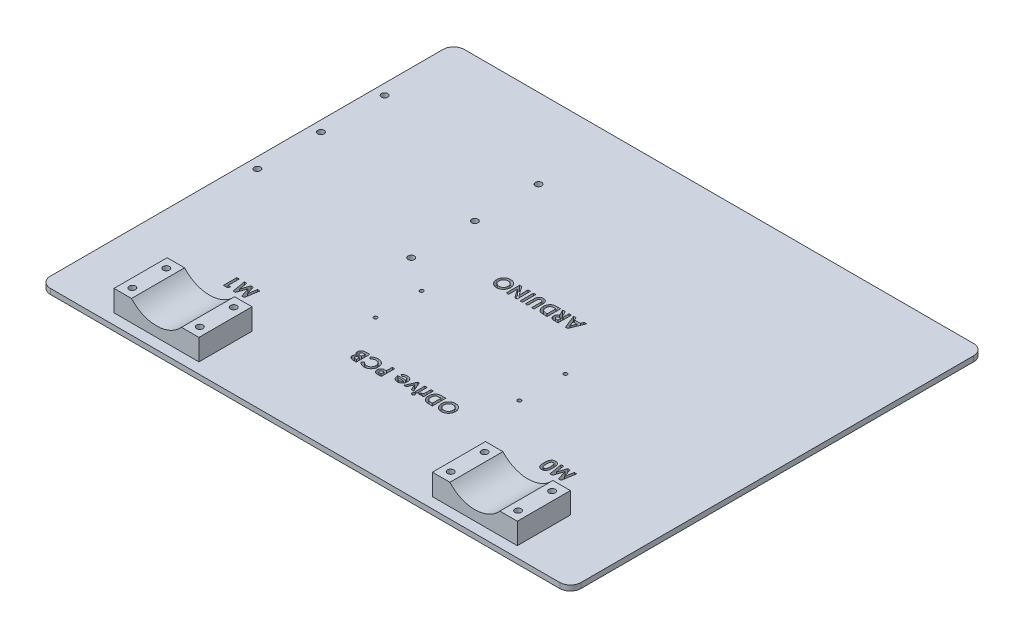
from build123d import *

# Parameters (mm, degrees)
BOSS_EXTRU_1_DEPTH      = 5
ENL_V_MAT_EXTRU_1_DEPTH = 292.590466236
BOSS_EXTRU_2_START      = -60
BOSS_EXTRU_2_DEPTH      = 50
ESQUISSE4_R             = 3
ENL_V_MAT_EXTRU_2_DEPTH = 293.617497913
ESQUISSE5_W             = 500
ESQUISSE5_H             = 100
BOSS_EXTRU_3_DEPTH      = 5
CONG_1_R                = 10
ESQUISSE6_R             = 3
ENL_V_MAT_EXTRU_3_DEPTH = 348.131099295
ESQUISSE7_W             = 15
ESQUISSE7_H             = 15
BOSS_EXTRU_4_DEPTH      = 10
CONG_2_R                = 5
ESQUISSE8_W             = 2.279487179
ESQUISSE8_H             = 9.280769231
ESQUISSE8_H_2           = 12.7
ENL_V_MAT_EXTRU_4_DEPTH = 348.131099295


with BuildPart() as part:
    # Esquisse1 → Boss.-Extru.1 (new body)
    with BuildSketch(Plane(origin=(0, 0, 0), x_dir=(1, 0, 0), z_dir=(0, 1, 0))):
        with BuildLine():
            Line((240, -150), (-240, -150))
            ThreePointArc((-240, -150), (-247.071067812, -147.071067812), (-250, -140))
            Line((-250, -140), (-250, 140))
            ThreePointArc((-250, 140), (-247.071067812, 147.071067812), (-240, 150))
            Line((-240, 150), (240, 150))
            ThreePointArc((240, 150), (247.071067812, 147.071067812), (250, 140))
            Line((250, 140), (250, -140))
            ThreePointArc((250, -140), (247.071067812, -147.071067812), (240, -150))
        make_face()
    extrude(amount=BOSS_EXTRU_1_DEPTH)

    # Esquisse2 → Enlèv. mat.-Extru.1 (cut, through all)
    with BuildSketch(Plane(origin=(0, 5, 0), x_dir=(1, 0, 0), z_dir=(0, 1, 0))):
        with BuildLine():
            add(Edge.make_bspline(
                [(74.199994386, -20.616261611), (74.199994732, -17.216263331), (70.799996452, -17.216262986), (70.799996106, -20.616261266), (70.799995761, -24.016259546), (74.199994041, -24.016259891), (74.199994386, -20.616261611)],
                knots=[0, 0, 0, 0, 0.5, 0.5, 0.5, 1, 1, 1, 1], degree=3, weights=[1, 0.333333333, 0.333333333, 1, 0.333333333, 0.333333333, 1]))
        make_face()
        with BuildLine():
            add(Edge.make_bspline(
                [(74.199998806, 22.883737749), (74.199999151, 26.283736029), (70.800000871, 26.283736374), (70.800000526, 22.883738094), (70.800000181, 19.483739814), (74.199998461, 19.483739469), (74.199998806, 22.883737749)],
                knots=[0, 0, 0, 0, 0.5, 0.5, 0.5, 1, 1, 1, 1], degree=3, weights=[1, 0.333333333, 0.333333333, 1, 0.333333333, 0.333333333, 1]))
        make_face()
        with BuildLine():
            add(Edge.make_bspline(
                [(-61.300006394, -20.616247845), (-61.300006048, -17.216249565), (-64.700004328, -17.216249219), (-64.700004674, -20.616247499), (-64.700005019, -24.016245779), (-61.300006739, -24.016246125), (-61.300006394, -20.616247845)],
                knots=[0, 0, 0, 0, 0.5, 0.5, 0.5, 1, 1, 1, 1], degree=3, weights=[1, 0.333333333, 0.333333333, 1, 0.333333333, 0.333333333, 1]))
        make_face()
        with BuildLine():
            add(Edge.make_bspline(
                [(-61.300001974, 22.883751515), (-61.300001629, 26.283749795), (-64.699999909, 26.283750141), (-64.700000254, 22.883751861), (-64.700000599, 19.483753581), (-61.300002319, 19.483753235), (-61.300001974, 22.883751515)],
                knots=[0, 0, 0, 0, 0.5, 0.5, 0.5, 1, 1, 1, 1], degree=3, weights=[1, 0.333333333, 0.333333333, 1, 0.333333333, 0.333333333, 1]))
        make_face()
    extrude(amount=-ENL_V_MAT_EXTRU_1_DEPTH, mode=Mode.SUBTRACT)

    # Esquisse3 → Boss.-Extru.2 (add)
    with BuildSketch(Plane.XY.offset(150).offset(BOSS_EXTRU_2_START)):
        with BuildLine():
            Line((-190, 5), (-110, 5))
            Line((-110, 5), (-110, 25))
            Line((-110, 25), (-126.444317397, 25))
            ThreePointArc((-126.444317397, 25), (-150, 14.413627546), (-173.555682603, 25))
            Line((-173.555682603, 25), (-190, 25))
            Line((-190, 25), (-190, 5))
        make_face()
    boss_extru_2 = extrude(amount=BOSS_EXTRU_2_DEPTH)

    # Esquisse4 → Enlèv. mat.-Extru.2 (cut, through all)
    with BuildSketch(Plane(origin=(0, 25, 0), x_dir=(1, 0, 0), z_dir=(0, 1, 0))):
        with Locations(Location((-181.777841301, -99, 0), (0, 0, 270))):
            Circle(ESQUISSE4_R)
        with Locations(Location((-181.777841301, -131, 0), (0, 0, 270))):
            Circle(ESQUISSE4_R)
        with Locations(Location((-118.222158699, -131, 0), (0, 0, 90))):
            Circle(ESQUISSE4_R)
        with Locations(Location((-118.222158699, -99, 0), (0, 0, 90))):
            Circle(ESQUISSE4_R)
    enl_v_mat_extru_2 = extrude(amount=-ENL_V_MAT_EXTRU_2_DEPTH, mode=Mode.SUBTRACT)

    # Symétrie1: Boss.-Extru.2, Enlèv. mat.-Extru.2 across plane
    add(boss_extru_2.mirror(Plane(origin=(0, 0, 0), x_dir=(0, 0, 1), z_dir=(1, 0, 0))))
    add(enl_v_mat_extru_2.mirror(Plane(origin=(0, 0, 0), x_dir=(0, 0, 1), z_dir=(1, 0, 0))), mode=Mode.SUBTRACT)

    # Esquisse5 → Boss.-Extru.3 (add)
    with BuildSketch(Plane(origin=(0, 5, 0), x_dir=(1, 0, 0), z_dir=(0, 1, 0))):
        with Locations((0, 190)):
            Rectangle(ESQUISSE5_W, ESQUISSE5_H)
    extrude(amount=-BOSS_EXTRU_3_DEPTH)

    # Congé1
    cong_1_edges = [part.edges().sort_by_distance(p)[0] for p in [
        (250, 2.5, -240),
        (-250, 2.5, -240),
    ]]
    fillet(cong_1_edges, radius=CONG_1_R)

    # Esquisse6 → Enlèv. mat.-Extru.3 (cut, through all)
    with BuildSketch(Plane(origin=(0, 5, 0), x_dir=(1, 0, 0), z_dir=(0, 1, 0))):
        with Locations(Location((-240, 165, 0), (0, 0, 270))):
            Circle(ESQUISSE6_R)
        with Locations(Location((-240, 105, 0), (0, 0, 270))):
            Circle(ESQUISSE6_R)
        with Locations(Location((-240, 45, 0), (0, 0, 270))):
            Circle(ESQUISSE6_R)
        with Locations(Location((-95, 165, 0), (0, 0, 270))):
            Circle(ESQUISSE6_R)
        with Locations(Location((-95, 105, 0), (0, 0, 270))):
            Circle(ESQUISSE6_R)
        with Locations(Location((-95, 45, 0), (0, 0, 270))):
            Circle(ESQUISSE6_R)
    extrude(amount=-ENL_V_MAT_EXTRU_3_DEPTH, mode=Mode.SUBTRACT)

    # Esquisse7 → Boss.-Extru.4 (add)
    with BuildSketch(Plane.XZ):
        with Locations((-230, 122.5)):
            Rectangle(ESQUISSE7_W, ESQUISSE7_H)
        with Locations((-230, -220)):
            Rectangle(ESQUISSE7_W, ESQUISSE7_H)
        with Locations((230, -220)):
            Rectangle(ESQUISSE7_W, ESQUISSE7_H)
        with Locations((230, 122.5)):
            Rectangle(ESQUISSE7_W, ESQUISSE7_H)
    extrude(amount=BOSS_EXTRU_4_DEPTH)

    # Congé2
    cong_2_edges = [part.edges().sort_by_distance(p)[0] for p in [
        (-222.5, 0, 122.5),
        (-222.5, -5, 115),
        (-230, 0, 130),
        (-222.5, -5, 130),
        (-237.5, 0, 122.5),
        (-237.5, -5, 130),
        (-230, 0, 115),
        (-237.5, -5, 115),
        (-222.5, 0, -220),
        (-222.5, -5, -227.5),
        (-230, 0, -212.5),
        (-222.5, -5, -212.5),
        (-237.5, 0, -220),
        (-237.5, -5, -212.5),
        (-230, 0, -227.5),
        (-237.5, -5, -227.5),
        (237.5, 0, -220),
        (237.5, -5, -227.5),
        (230, 0, -212.5),
        (237.5, -5, -212.5),
        (222.5, 0, -220),
        (222.5, -5, -212.5),
        (230, 0, -227.5),
        (222.5, -5, -227.5),
        (237.5, 0, 122.5),
        (237.5, -5, 115),
        (230, 0, 130),
        (237.5, -5, 130),
        (222.5, 0, 122.5),
        (222.5, -5, 130),
        (230, 0, 115),
        (222.5, -5, 115),
    ]]
    fillet(cong_2_edges, radius=CONG_2_R)

    # Esquisse8 → Enlèv. mat.-Extru.4 (cut, through all)
    # profile 1 of 21: a face of its own
    with BuildSketch(Plane(origin=(0, 5, 0), x_dir=(1, 0, 0), z_dir=(0, 1, 0))):
        Polygon((157.247771015, -66.045283743), (154.881785438, -66.045283743), (151.984089124, -57.186830218), (149.066040246, -66.045283743), (146.722951303, -66.045283743), (144.57575579, -53.345283743), (146.883227746, -53.345283743), (148.239217329, -61.36673807), (150.879962521, -53.345283743), (153.103480149, -53.345283743), (155.728960919, -61.36673807), (157.082406432, -53.345283743), (159.392422457, -53.345283743), align=None)
    # profile 2 of 21: a face of its own
    with BuildSketch(Plane(origin=(0, 5, 0), x_dir=(1, 0, 0), z_dir=(0, 1, 0))):
        with BuildLine():
            add(Edge.make_bspline(
                [(139.159429669, -66.370924769), (139.049092744, -66.369287335), (138.832140872, -66.366067702), (138.512616467, -66.331177096), (138.204807433, -66.278507249), (137.907596708, -66.204909002), (137.622807078, -66.108014943), (137.349204377, -65.990073551), (137.086119642, -65.853273925), (136.835932387, -65.692114657), (136.599658675, -65.508745412), (136.375670316, -65.303719169), (136.168591034, -65.073707491), (135.971062977, -64.8243253), (135.790921767, -64.550078112), (135.62303028, -64.255440989), (135.469941472, -63.937264085), (135.329519921, -63.595329443), (135.203905684, -63.224424103), (135.098397905, -62.820260958), (135.006673055, -62.383127159), (134.934437005, -61.910746141), (134.875313554, -61.404231977), (134.836682933, -60.862636924), (134.809808816, -60.2874766), (134.80763951, -59.892907172), (134.806525021, -59.690195602)],
                knots=[0, 0, 0, 0, 0.879038005, 1.72842358, 2.558443055, 3.366573136, 4.165922485, 4.953092809, 5.739101687, 6.526504095, 7.321412341, 8.120218626, 8.943108119, 9.785446297, 10.653345205, 11.555363108, 12.486387694, 13.465363381, 14.499809521, 15.604758044, 16.79243262, 18.058048538, 19.411969755, 20.855614229, 22.384559651, 24, 24, 24, 24], degree=3))
            add(Edge.make_bspline(
                [(134.806525021, -59.690195602), (134.807738122, -59.484949198), (134.810095154, -59.086159115), (134.835483777, -58.505720075), (134.879218009, -57.960255288), (134.935542459, -57.449806825), (135.012840822, -56.974692919), (135.102720376, -56.534321135), (135.211081548, -56.128578985), (135.340152501, -55.757532185), (135.480440522, -55.414456537), (135.632598112, -55.09675773), (135.796526709, -54.801944222), (135.97045004, -54.529325825), (136.160101663, -54.282280839), (136.357640962, -54.057202746), (136.568706314, -53.857241793), (136.789889911, -53.678111284), (137.026631343, -53.521320608), (137.277872308, -53.386614009), (137.545312635, -53.275292182), (137.825060498, -53.179339487), (138.122092901, -53.110306207), (138.431823471, -53.055575666), (138.757711438, -53.025318414), (138.979590555, -53.021565667), (139.093283835, -53.019642718)],
                knots=[0, 0, 0, 0, 1.643729521, 3.193736973, 4.651750042, 6.025799905, 7.305391353, 8.505533933, 9.624215592, 10.665924642, 11.64969722, 12.591402044, 13.485259159, 14.34997443, 15.17859563, 15.977254476, 16.745893235, 17.504291679, 18.254003551, 19.016677942, 19.783634514, 20.571857866, 21.382327253, 22.223106266, 23.08950026, 24, 24, 24, 24], degree=3))
            add(Edge.make_bspline(
                [(139.093283835, -53.019642718), (139.206971607, -53.021611424), (139.429684279, -53.025468089), (139.756487779, -53.055254624), (140.068548778, -53.111015016), (140.368382831, -53.178846146), (140.653138155, -53.276007262), (140.926057484, -53.388342788), (141.182476128, -53.527441665), (141.427126357, -53.682866702), (141.656093578, -53.862022631), (141.872785504, -54.062051769), (142.080229532, -54.280161808), (142.27103621, -54.52392843), (142.448617493, -54.788899744), (142.614859867, -55.075038516), (142.766379429, -55.383281228), (142.908272106, -55.713540214), (143.033717453, -56.073757552), (143.142263893, -56.467247809), (143.23268228, -56.897391322), (143.310090688, -57.362281255), (143.362574659, -57.864596538), (143.407314475, -58.401375977), (143.432378752, -58.974224401), (143.43477729, -59.367924221), (143.436012201, -59.570624288)],
                knots=[0, 0, 0, 0, 0.917300563, 1.796978314, 2.644037383, 3.473869551, 4.274468802, 5.068727038, 5.852392514, 6.624895937, 7.405058545, 8.194438634, 9.002807344, 9.831001702, 10.688798588, 11.574866558, 12.499006576, 13.458565112, 14.473491784, 15.574131657, 16.749764288, 18.018652109, 19.374999853, 20.823441246, 22.364518758, 24, 24, 24, 24], degree=3))
            add(Edge.make_bspline(
                [(143.436012201, -59.570624288), (143.433800737, -59.852259042), (143.429533689, -60.395676928), (143.376844945, -61.180868514), (143.297141209, -61.906104248), (143.188032919, -62.572260416), (143.041075943, -63.17803314), (142.860727908, -63.723248418), (142.653790625, -64.213303178), (142.477733856, -64.503661596), (142.39294329, -64.643500891)],
                knots=[0, 0, 0, 0, 1.288526675, 2.486228817, 3.599112392, 4.626206381, 5.5730174, 6.447949553, 7.252518174, 8, 8, 8, 8], degree=3))
            add(Edge.make_bspline(
                [(142.39294329, -64.643500891), (142.294333154, -64.780875163), (142.101530905, -65.049468935), (141.764410785, -65.402082351), (141.402219108, -65.703654611), (141.007516664, -65.947360865), (140.586545836, -66.139547637), (140.135692377, -66.275286989), (139.656621211, -66.354375061), (139.32763505, -66.36532582), (139.159429669, -66.370924769)],
                knots=[0, 0, 0, 0, 1.058512271, 2.069600068, 3.047294572, 4.004278952, 4.967380941, 5.939006123, 6.946246673, 8, 8, 8, 8], degree=3))
        make_face()
        with BuildLine():
            add(Edge.make_bspline(
                [(139.103460117, -64.091437589), (139.203176741, -64.086659126), (139.398674256, -64.0772908), (139.682094229, -63.999543624), (139.947007291, -63.875930877), (140.152039232, -63.733878077), (140.303084527, -63.592348741), (140.413067049, -63.468332573), (140.511527515, -63.323174242), (140.606418515, -63.163223212), (140.6917091, -62.983604555), (140.773898613, -62.789134082), (140.844131406, -62.574931658), (140.911274248, -62.342831304), (140.969220551, -62.087087517), (141.020299022, -61.80530872), (141.062271403, -61.496246543), (141.098889901, -61.159559796), (141.121838145, -60.795323682), (141.144158053, -60.403628391), (141.152266045, -59.983640147), (141.155075263, -59.694434473), (141.156525021, -59.545183583)],
                knots=[0, 0, 0, 0, 1.076633864, 2.110773886, 3.152647947, 4.225997476, 4.790367519, 5.388085217, 6.013768813, 6.68363944, 7.397140436, 8.161658524, 8.964785566, 9.832512219, 10.773307679, 11.798385074, 12.927758018, 14.144797317, 15.459104848, 16.872968649, 18.386227327, 20, 20, 20, 20], degree=3))
            add(Edge.make_bspline(
                [(141.156525021, -59.545183583), (141.154197183, -59.351817773), (141.14973338, -58.981024495), (141.126420315, -58.447813341), (141.079410377, -57.961703274), (141.021557376, -57.521110923), (140.940509947, -57.127420938), (140.841271216, -56.780732491), (140.730694528, -56.477155196), (140.592120643, -56.221892409), (140.44363727, -56.003592542), (140.285157849, -55.814751719), (140.11391459, -55.657445142), (139.935026946, -55.523894964), (139.74186077, -55.424726151), (139.53837706, -55.352428892), (139.324124093, -55.30834754), (139.17743998, -55.302220207), (139.103460117, -55.299129897)],
                knots=[0, 0, 0, 0, 1.772038313, 3.39801485, 4.888833602, 6.246074539, 7.468356166, 8.567794639, 9.549176812, 10.42180448, 11.221452581, 11.965716786, 12.675085657, 13.348110381, 14.005015947, 14.656336226, 15.322325655, 16, 16, 16, 16], degree=3))
            add(Edge.make_bspline(
                [(139.103460117, -55.299129897), (139.032016255, -55.301242009), (138.892138057, -55.305377262), (138.688164316, -55.347825073), (138.495272254, -55.416835995), (138.31404427, -55.514456789), (138.143832138, -55.638596564), (137.985467751, -55.789800845), (137.840145459, -55.969576785), (137.755480032, -56.10299712), (137.711853547, -56.171746083)],
                knots=[0, 0, 0, 0, 0.992283464, 1.942767638, 2.88273346, 3.832339453, 4.79467288, 5.803907806, 6.868395428, 8, 8, 8, 8], degree=3))
            add(Edge.make_bspline(
                [(137.711853547, -56.171746083), (137.660474847, -56.265686203), (137.55273788, -56.462671017), (137.428380647, -56.795141643), (137.322294399, -57.169641292), (137.237252779, -57.589198015), (137.169894107, -58.052128356), (137.118398391, -58.558776378), (137.092241982, -59.109868308), (137.088142668, -59.49173463), (137.086012201, -59.690195602)],
                knots=[0, 0, 0, 0, 0.710996797, 1.490902623, 2.352723643, 3.296875318, 4.334065587, 5.461510359, 6.680713396, 8, 8, 8, 8], degree=3))
            add(Edge.make_bspline(
                [(137.086012201, -59.690195602), (137.08684984, -59.890373154), (137.088462152, -60.27568077), (137.118043466, -60.828835157), (137.159237644, -61.334049962), (137.219493038, -61.790196913), (137.297021925, -62.198384409), (137.392578548, -62.558582344), (137.505226545, -62.871511409), (137.638833014, -63.136825593), (137.786749461, -63.362386075), (137.943968721, -63.555632199), (138.110762666, -63.722002038), (138.288928424, -63.856851859), (138.477277009, -63.964330603), (138.67682464, -64.03757509), (138.886907504, -64.082632638), (139.030301609, -64.088462991), (139.103460117, -64.091437589)],
                knots=[0, 0, 0, 0, 1.793903324, 3.452957663, 4.963427329, 6.336122014, 7.574844885, 8.684777121, 9.673127442, 10.55010789, 11.340650774, 12.086136756, 12.779466299, 13.446812155, 14.083183996, 14.715685896, 15.34475337, 16, 16, 16, 16], degree=3))
        make_face(mode=Mode.SUBTRACT)
    # profile 3 of 21: a face of its own
    with BuildSketch(Plane(origin=(0, 5, 0), x_dir=(1, 0, 0), z_dir=(0, 1, 0))):
        Polygon((-141.239806667, -66.045283743), (-143.605792244, -66.045283743), (-146.503488558, -57.186830218), (-149.421537436, -66.045283743), (-151.764626378, -66.045283743), (-153.911821891, -53.345283743), (-151.604349936, -53.345283743), (-150.248360353, -61.36673807), (-147.60761516, -53.345283743), (-145.384097532, -53.345283743), (-142.758616763, -61.36673807), (-141.40517125, -53.345283743), (-139.095155225, -53.345283743), align=None)
    # profile 4 of 21: a face of its own
    with BuildSketch(Plane(origin=(0, 5, 0), x_dir=(1, 0, 0), z_dir=(0, 1, 0))):
        Polygon((-157.389566282, -66.045283743), (-160.913103942, -66.045283743), (-160.913103942, -53.345283743), (-158.633616763, -53.345283743), (-158.633616763, -63.928617077), (-156.028488558, -63.928617077), align=None)
    # profile 5 of 21: a face of its own
    with BuildSketch(Plane(origin=(0, 5, 0), x_dir=(1, 0, 0), z_dir=(0, 1, 0))):
        with BuildLine():
            add(Edge.make_bspline(
                [(44.846009166, -66.370924769), (44.625203, -66.365210027), (44.189281616, -66.353927833), (43.548217649, -66.259811025), (42.930359896, -66.106637681), (42.335619789, -65.892832359), (41.766025684, -65.615935293), (41.219484746, -65.279728406), (40.697494715, -64.881358848), (40.206141471, -64.426511366), (39.755582574, -63.929149877), (39.359536186, -63.398890877), (39.023343003, -62.841209069), (38.750454185, -62.255995794), (38.537347697, -61.644054907), (38.389241196, -61.005154169), (38.293745634, -60.340111727), (38.282788064, -59.887270182), (38.277219102, -59.657122686)],
                knots=[0, 0, 0, 0, 1.014151002, 2.002163778, 2.969868608, 3.93493411, 4.9003771, 5.874719092, 6.87846472, 7.912488755, 8.947011879, 9.957751389, 10.948740761, 11.933621513, 12.919426746, 13.920294397, 14.943031967, 16, 16, 16, 16], degree=3))
            add(Edge.make_bspline(
                [(38.277219102, -59.657122686), (38.283151679, -59.429568858), (38.294842012, -58.981166739), (38.3853311, -58.322246686), (38.536011738, -57.690212839), (38.745009786, -57.084849124), (39.013127089, -56.50614562), (39.344185952, -55.955980151), (39.736011308, -55.433222293), (40.180599275, -54.941074666), (40.667032443, -54.491445287), (41.185318188, -54.096725922), (41.73064137, -53.7647305), (42.299517832, -53.489167175), (42.897314279, -53.282089177), (43.517402987, -53.127090682), (44.164971177, -53.037462017), (44.604900805, -53.02564222), (44.828200673, -53.019642718)],
                knots=[0, 0, 0, 0, 1.051517626, 2.07204922, 3.067438659, 4.05042616, 5.027204762, 6.009981242, 7.012629434, 8.042243656, 9.071350414, 10.070091277, 11.048190212, 12.017682766, 12.985867053, 13.966945899, 14.968060614, 16, 16, 16, 16], degree=3))
            add(Edge.make_bspline(
                [(44.828200673, -53.019642718), (45.061763635, -53.024961475), (45.520682931, -53.035412106), (46.192480091, -53.133954487), (46.835202495, -53.284195469), (47.447089066, -53.50170826), (48.027664133, -53.784335849), (48.579531328, -54.125587095), (49.098540119, -54.532053734), (49.582960497, -54.991476042), (50.02179541, -55.494315182), (50.40916666, -56.02548631), (50.735919548, -56.580972494), (51.002070858, -57.1610231), (51.21189364, -57.762036027), (51.359899827, -58.38767088), (51.447330601, -59.036427359), (51.459509201, -59.47707572), (51.465680641, -59.700371884)],
                knots=[0, 0, 0, 0, 1.067953136, 2.098381936, 3.099641766, 4.083805132, 5.062469929, 6.048665414, 7.046702845, 8.073106546, 9.098695993, 10.09591865, 11.076726721, 12.041940862, 13.011263376, 13.984305721, 14.978557872, 16, 16, 16, 16], degree=3))
            add(Edge.make_bspline(
                [(51.465680641, -59.700371884), (51.463716964, -59.850587341), (51.459814476, -60.149116182), (51.413837065, -60.591635518), (51.345646945, -61.0248832), (51.252296305, -61.449673939), (51.126521955, -61.86491302), (50.973653447, -62.27164786), (50.795513452, -62.669876212), (50.590087062, -63.055996662), (50.35770883, -63.42538949), (50.109591576, -63.781280992), (49.836231886, -64.114328313), (49.543272023, -64.428149167), (49.229564491, -64.721309007), (48.89456293, -64.994808846), (48.538794629, -65.247951108), (48.166107696, -65.482827622), (47.777777005, -65.688542955), (47.383041674, -65.875008843), (46.978112291, -66.026195335), (46.565928919, -66.151412747), (46.147439202, -66.251904807), (45.719412033, -66.318723458), (45.285459865, -66.365064096), (44.992840367, -66.368966575), (44.846009166, -66.370924769)],
                knots=[0, 0, 0, 0, 1.034641744, 2.056182551, 3.061960284, 4.05571729, 5.050247014, 6.048716841, 7.047801973, 8.054190544, 9.059424999, 10.053182006, 11.041513076, 12.025412457, 13.009311837, 13.997642908, 15.002928308, 16.016213968, 17.030509951, 18.02913364, 19.022134519, 20.005478534, 20.996155877, 21.984625117, 22.988721131, 24, 24, 24, 24], degree=3))
        make_face()
        with BuildLine():
            add(Edge.make_bspline(
                [(44.881626153, -64.091437589), (45.030227926, -64.087450265), (45.323508359, -64.079580882), (45.753697466, -64.019626976), (46.166693729, -63.923873398), (46.560209963, -63.785176842), (46.935943505, -63.608646572), (47.294591082, -63.394920767), (47.631069882, -63.136571137), (47.950315091, -62.847776588), (48.237728053, -62.524663836), (48.496151238, -62.182166133), (48.705096871, -61.812042409), (48.884760286, -61.426483538), (49.017469507, -61.015739145), (49.118513739, -60.586475578), (49.173549104, -60.134286141), (49.181918628, -59.826863023), (49.186193461, -59.669843038)],
                knots=[0, 0, 0, 0, 1.033668485, 2.040047952, 3.016132939, 3.979056467, 4.937231767, 5.900589077, 6.877725736, 7.88429546, 8.891280164, 9.882584218, 10.863295226, 11.842887319, 12.837417301, 13.860812229, 14.907384602, 16, 16, 16, 16], degree=3))
            add(Edge.make_bspline(
                [(49.186193461, -59.669843038), (49.180997192, -59.495781115), (49.170813367, -59.154648587), (49.100201163, -58.656746879), (48.976474818, -58.187069126), (48.807449722, -57.744044096), (48.582767155, -57.332330451), (48.314041733, -56.946936855), (47.994545159, -56.590254475), (47.748840134, -56.381834938), (47.624134166, -56.276052974)],
                knots=[0, 0, 0, 0, 1.078343132, 2.113373867, 3.107373148, 4.082093053, 5.043582658, 6.005574554, 6.987742499, 8, 8, 8, 8], degree=3))
            add(Edge.make_bspline(
                [(47.624134166, -56.276052974), (47.521948956, -56.197917714), (47.319880784, -56.043407594), (46.99733599, -55.845371178), (46.665178363, -55.675634215), (46.320901359, -55.538488756), (45.965232072, -55.430612444), (45.598219277, -55.355068436), (45.220382998, -55.307658038), (44.964872399, -55.301991597), (44.835832884, -55.299129897)],
                knots=[0, 0, 0, 0, 1.023928204, 2.024787132, 3.009472467, 3.9914905, 4.972207045, 5.96565515, 6.972602802, 8, 8, 8, 8], degree=3))
            add(Edge.make_bspline(
                [(44.835832884, -55.299129897), (44.68978915, -55.303156735), (44.40244351, -55.311079665), (43.980222239, -55.370214035), (43.575909066, -55.470728697), (43.185756433, -55.607223968), (42.814988777, -55.790151272), (42.457824254, -56.007363417), (42.11851965, -56.265634782), (41.801211307, -56.561707197), (41.510415173, -56.884835188), (41.253141521, -57.229185426), (41.040076525, -57.594771308), (40.862353199, -57.976709399), (40.723886937, -58.378040725), (40.629126863, -58.798795556), (40.568226379, -59.237276338), (40.560594333, -59.535649164), (40.556706282, -59.687651532)],
                knots=[0, 0, 0, 0, 1.026350473, 2.019376834, 2.989435443, 3.95094063, 4.91865229, 5.889827372, 6.885283771, 7.910196595, 8.935871797, 9.9372888, 10.925850568, 11.904605667, 12.894245083, 13.903507864, 14.931967858, 16, 16, 16, 16], degree=3))
            add(Edge.make_bspline(
                [(40.556706282, -59.687651532), (40.560713799, -59.83878608), (40.568601985, -60.136271389), (40.628067743, -60.573535773), (40.726927543, -60.991978695), (40.866648036, -61.392678795), (41.040710697, -61.777739718), (41.259362377, -62.143819467), (41.517863692, -62.490601317), (41.811489019, -62.816023606), (42.131029572, -63.115085891), (42.474102141, -63.374612483), (42.831090759, -63.600134167), (43.210190781, -63.776798428), (43.603645024, -63.917546556), (44.013854665, -64.021195475), (44.442373316, -64.079159718), (44.733903418, -64.087308485), (44.881626153, -64.091437589)],
                knots=[0, 0, 0, 0, 1.055040155, 2.076685641, 3.074845078, 4.052329834, 5.035358467, 6.020382375, 7.023447318, 8.050688466, 9.077178457, 10.074336316, 11.0503314, 12.019748348, 12.988025369, 13.964577102, 14.968620271, 16, 16, 16, 16], degree=3))
        make_face(mode=Mode.SUBTRACT)
    # profile 6 of 21: a face of its own
    with BuildSketch(Plane(origin=(0, 5, 0), x_dir=(1, 0, 0), z_dir=(0, 1, 0))):
        with BuildLine():
            Line((35.997731923, -66.045283743), (33.125476314, -66.045283743))
            add(Edge.make_bspline(
                [(33.125476314, -66.045283743), (32.901545499, -66.043754557), (32.468684702, -66.040798622), (31.841643697, -66.006219297), (31.258139342, -65.955441114), (30.719491617, -65.877727394), (30.223760816, -65.787528469), (29.7746062, -65.666732947), (29.368372368, -65.528109689), (29.000795912, -65.366594465), (28.666150888, -65.177174497), (28.350647668, -64.964369021), (28.050643937, -64.724985452), (27.764477133, -64.458466535), (27.491449862, -64.166584345), (27.237971212, -63.843461592), (26.995914839, -63.497467583), (26.769208131, -63.127401462), (26.567410846, -62.73399383), (26.387788639, -62.323436642), (26.238130897, -61.895463061), (26.116274251, -61.450664011), (26.019208697, -60.990327967), (25.951276711, -60.513577819), (25.90928482, -60.020840637), (25.905024776, -59.686888997), (25.902860128, -59.517198807)],
                knots=[0, 0, 0, 0, 1.44349102, 2.790284463, 4.047513061, 5.218094321, 6.297837468, 7.293772999, 8.213586047, 9.062895527, 9.878013142, 10.689252941, 11.514048747, 12.349645483, 13.208421871, 14.087867281, 14.994836234, 15.929653487, 16.883274053, 17.843080533, 18.816554169, 19.803369425, 20.81449504, 21.847452076, 22.906230055, 24, 24, 24, 24], degree=3))
            add(Edge.make_bspline(
                [(25.902860128, -59.517198807), (25.908527772, -59.277754589), (25.919684861, -58.80639463), (26.013676106, -58.114683591), (26.165666987, -57.451593177), (26.379466485, -56.822386887), (26.644220348, -56.232392561), (26.961295784, -55.693428808), (27.321584612, -55.204397016), (27.728283975, -54.77341123), (28.167944827, -54.400705069), (28.626630724, -54.085227815), (29.103931308, -53.831999823), (29.525385692, -53.673865624), (29.891868534, -53.574477632), (30.213160535, -53.51673986), (30.578818612, -53.463190443), (30.990220912, -53.417163304), (31.448587425, -53.385643807), (31.952498764, -53.363877371), (32.502076982, -53.347703523), (32.883776584, -53.346111471), (33.082227115, -53.345283743)],
                knots=[0, 0, 0, 0, 1.315347898, 2.589339334, 3.828278609, 5.048487211, 6.235212834, 7.375728391, 8.47833097, 9.56625089, 10.624194351, 11.640157642, 12.619895326, 13.585848527, 14.106971868, 14.704705962, 15.37825295, 16.137840974, 16.978850452, 17.902510282, 18.909488129, 20, 20, 20, 20], degree=3))
            Line((33.082227115, -53.345283743), (35.997731923, -53.345283743))
            Line((35.997731923, -53.345283743), (35.997731923, -66.045283743))
        make_face()
        with BuildLine():
            Line((33.718244743, -63.765796564), (33.718244743, -55.624770923))
            Line((33.718244743, -55.624770923), (32.527619743, -55.624770923))
            add(Edge.make_bspline(
                [(32.527619743, -55.624770923), (32.385978215, -55.625456809), (32.113595656, -55.626775796), (31.719856436, -55.644898524), (31.356488688, -55.674327682), (31.023016451, -55.717857839), (30.718673095, -55.77023576), (30.444568782, -55.835020344), (30.200163257, -55.913803332), (29.983441049, -56.006649881), (29.785578456, -56.112654812), (29.602274771, -56.236435888), (29.425364351, -56.373995914), (29.258117, -56.529256142), (29.099909529, -56.700194414), (28.951677483, -56.887682671), (28.811433866, -57.091149238), (28.682814548, -57.311677974), (28.565170601, -57.546906036), (28.461235225, -57.794687635), (28.373494739, -58.056373565), (28.306864387, -58.331847991), (28.250104108, -58.619401475), (28.209118833, -58.920882896), (28.186789914, -59.235307298), (28.183842615, -59.449323255), (28.182347307, -59.557903936)],
                knots=[0, 0, 0, 0, 1.502729547, 2.8898115, 4.181010027, 5.369596896, 6.45687185, 7.456390247, 8.355533714, 9.177830239, 9.954819978, 10.733423081, 11.521791071, 12.330436719, 13.151797389, 13.990712567, 14.864234656, 15.771624029, 16.697123225, 17.652960569, 18.620374037, 19.622036587, 20.657870943, 21.729319508, 22.8479736, 24, 24, 24, 24], degree=3))
            add(Edge.make_bspline(
                [(28.182347307, -59.557903936), (28.185373999, -59.724288008), (28.191275815, -60.048724057), (28.248547429, -60.521209153), (28.340828709, -60.965567773), (28.475257029, -61.380658401), (28.64056871, -61.769119953), (28.850765968, -62.125946616), (29.093079295, -62.456987162), (29.28480485, -62.651150568), (29.380604519, -62.748168359)],
                knots=[0, 0, 0, 0, 1.138242922, 2.219485503, 3.251901297, 4.239342788, 5.201071, 6.134757343, 7.067992642, 8, 8, 8, 8], degree=3))
            add(Edge.make_bspline(
                [(29.380604519, -62.748168359), (29.475064195, -62.830843437), (29.667987387, -62.999697922), (30.006697115, -63.202028778), (30.379937693, -63.379796267), (30.796247746, -63.52074606), (31.251603823, -63.632215165), (31.748718034, -63.709092682), (32.284928225, -63.758493359), (32.656402151, -63.763310007), (32.848172628, -63.765796564)],
                knots=[0, 0, 0, 0, 0.813307809, 1.661089106, 2.549956539, 3.493439533, 4.508053171, 5.589449661, 6.755572447, 8, 8, 8, 8], degree=3))
            Line((32.848172628, -63.765796564), (33.718244743, -63.765796564))
        make_face(mode=Mode.SUBTRACT)
    # profile 7 of 21: a face of its own
    with BuildSketch(Plane(origin=(0, 5, 0), x_dir=(1, 0, 0), z_dir=(0, 1, 0))):
        with BuildLine():
            Line((24.274655, -62.626052974), (22.320808846, -62.626052974))
            Line((22.320808846, -62.626052974), (22.320808846, -61.483765314))
            add(Edge.make_bspline(
                [(22.320808846, -61.483765314), (22.265593013, -61.585339168), (22.157671376, -61.783869479), (21.958091508, -62.049870182), (21.731821978, -62.277908704), (21.479258652, -62.462770584), (21.209016962, -62.609753603), (20.922722685, -62.710562594), (20.625386332, -62.77845344), (20.421615296, -62.785375128), (20.318625352, -62.788873487)],
                knots=[0, 0, 0, 0, 1.098409642, 2.146887215, 3.15060926, 4.142663133, 5.113340811, 6.064933309, 7.021978713, 8, 8, 8, 8], degree=3))
            add(Edge.make_bspline(
                [(20.318625352, -62.788873487), (20.24378896, -62.785690629), (20.091242348, -62.779202686), (19.860329766, -62.732630842), (19.623581728, -62.662857999), (19.469089853, -62.594754345), (19.390039615, -62.559907141)],
                knots=[0, 0, 0, 0, 0.931681262, 1.899140464, 2.92503444, 4, 4, 4, 4], degree=3))
            Line((19.390039615, -62.559907141), (20.097291218, -60.628957621))
            add(Edge.make_bspline(
                [(20.097291218, -60.628957621), (20.160509411, -60.659501596), (20.279335279, -60.71691251), (20.451849808, -60.784663304), (20.608413895, -60.826001527), (20.707672653, -60.832169552), (20.75366141, -60.835027333)],
                knots=[0, 0, 0, 0, 1.214386998, 2.282580073, 3.20428172, 4, 4, 4, 4], degree=3))
            add(Edge.make_bspline(
                [(20.75366141, -60.835027333), (20.797094547, -60.833149662), (20.882535011, -60.829455958), (21.00845386, -60.797297832), (21.128230216, -60.742983565), (21.242751118, -60.668762875), (21.351742182, -60.574273585), (21.456701841, -60.460120317), (21.550547908, -60.320315096), (21.649243712, -60.164250187), (21.733307383, -59.973367263), (21.805660845, -59.745493648), (21.868766569, -59.477650914), (21.918269729, -59.169827222), (21.955282574, -58.822415388), (21.982503888, -58.435466484), (22.000915067, -58.008741498), (22.002154225, -57.710929781), (22.002800032, -57.555720442)],
                knots=[0, 0, 0, 0, 0.544259334, 1.070651881, 1.618331981, 2.187895439, 2.776420197, 3.424094598, 4.12659612, 4.885633066, 5.737955424, 6.733832302, 7.882163033, 9.186958323, 10.642647142, 12.264016219, 14.052932313, 16, 16, 16, 16], degree=3))
            Line((22.002800032, -57.555720442), (21.99516782, -57.102875891))
            Line((21.99516782, -57.102875891), (21.99516782, -53.345283743))
            Line((21.99516782, -53.345283743), (24.274655, -53.345283743))
            Line((24.274655, -53.345283743), (24.274655, -62.626052974))
        make_face()
    # profile 8 of 21: a face of its own
    with BuildSketch(Plane(origin=(0, 5, 0), x_dir=(1, 0, 0), z_dir=(0, 1, 0))):
        with BuildLine():
            add(Edge.make_bspline(
                [(17.278461089, -66.533745282), (17.180180066, -66.528984206), (16.987195807, -66.519635376), (16.711724042, -66.426654285), (16.456421201, -66.285465058), (16.233508523, -66.085871019), (16.044902904, -65.849414091), (15.908554043, -65.580144495), (15.823530345, -65.287145416), (15.813241208, -65.083357351), (15.807988333, -64.979318198)],
                knots=[0, 0, 0, 0, 0.989651449, 1.943275965, 2.90597644, 3.919767043, 4.944608933, 5.944551278, 6.950639519, 8, 8, 8, 8], degree=3))
            add(Edge.make_bspline(
                [(15.807988333, -64.979318198), (15.813571888, -64.876234317), (15.824495987, -64.674553038), (15.90449872, -64.383404935), (16.043885562, -64.120000576), (16.227812571, -63.883846634), (16.452474271, -63.691108962), (16.700418922, -63.542598531), (16.974334262, -63.455659144), (17.164230674, -63.445376606), (17.260652596, -63.440155538)],
                knots=[0, 0, 0, 0, 1.052725588, 2.059633778, 3.055596988, 4.079986438, 5.099674807, 6.062641398, 7.01628558, 8, 8, 8, 8], degree=3))
            add(Edge.make_bspline(
                [(17.260652596, -63.440155538), (17.359720989, -63.44501728), (17.554245691, -63.454563502), (17.833798381, -63.546332833), (18.089192872, -63.693599215), (18.313787815, -63.895434345), (18.50032482, -64.135160701), (18.642744862, -64.403349413), (18.722324371, -64.700955955), (18.733185126, -64.906784546), (18.738757564, -65.012391115)],
                knots=[0, 0, 0, 0, 0.989280592, 1.942491504, 2.912382296, 3.922750976, 4.94514089, 5.940052451, 6.943081751, 8, 8, 8, 8], degree=3))
            add(Edge.make_bspline(
                [(18.738757564, -65.012391115), (18.733128793, -65.113793786), (18.722071884, -65.312984695), (18.642009306, -65.60056564), (18.503320675, -65.862872994), (18.315073437, -66.093011753), (18.095504117, -66.290648957), (17.841866983, -66.430007256), (17.567530276, -66.518652721), (17.37581241, -66.528662482), (17.278461089, -66.533745282)],
                knots=[0, 0, 0, 0, 1.038763745, 2.040501419, 3.031928819, 4.058179968, 5.07455544, 6.03952971, 7.004503979, 8, 8, 8, 8], degree=3))
        make_face()
    # profile 9 of 21: a face of its own
    with BuildSketch(Plane(origin=(0, 5, 0), x_dir=(1, 0, 0), z_dir=(0, 1, 0))):
        with Locations((17.273372949, -57.985668359)):
            Rectangle(ESQUISSE8_W, ESQUISSE8_H)
    # profile 10 of 21: a face of its own
    with BuildSketch(Plane(origin=(0, 5, 0), x_dir=(1, 0, 0), z_dir=(0, 1, 0))):
        Polygon((15.075296025, -62.626052974), (12.755103718, -62.626052974), (10.353501153, -57.14866916), (7.951898589, -62.626052974), (5.631706282, -62.626052974), (9.697130961, -53.345283743), (11.009871346, -53.345283743), align=None)
    # profile 11 of 21: a face of its own
    with BuildSketch(Plane(origin=(0, 5, 0), x_dir=(1, 0, 0), z_dir=(0, 1, 0))):
        with BuildLine():
            Line((-5.025405097, -57.415796564), (2.293885769, -57.415796564))
            add(Edge.make_bspline(
                [(2.293885769, -57.415796564), (2.278924775, -57.33076449), (2.249525242, -57.163669755), (2.186578261, -56.921486426), (2.103489888, -56.693422234), (2.007929406, -56.477603778), (1.896109348, -56.274794776), (1.764071797, -56.087699789), (1.617570108, -55.91246858), (1.453828909, -55.751663838), (1.277043159, -55.607153031), (1.086730836, -55.481521661), (0.885991823, -55.374281496), (0.672534047, -55.287727637), (0.448069832, -55.218300108), (0.211110889, -55.170664884), (-0.037494721, -55.142464702), (-0.20686096, -55.138391457), (-0.293433943, -55.136309384)],
                knots=[0, 0, 0, 0, 1.091578896, 2.145038655, 3.15928737, 4.157766048, 5.127497078, 6.082469626, 7.049112333, 8.012179284, 8.980248595, 9.932024523, 10.891502393, 11.853374471, 12.840501167, 13.858428296, 14.905317556, 16, 16, 16, 16], degree=3))
            add(Edge.make_bspline(
                [(-0.293433943, -55.136309384), (-0.397932519, -55.139068248), (-0.60372099, -55.144501262), (-0.905202633, -55.192684031), (-1.196779297, -55.265461985), (-1.475691641, -55.373688912), (-1.745170425, -55.508412411), (-2.000779202, -55.676261313), (-2.246942359, -55.872330526), (-2.397130894, -56.0234606), (-2.473702372, -56.100512109)],
                knots=[0, 0, 0, 0, 1.021034703, 2.010718019, 2.977989445, 3.954245119, 4.929443971, 5.918328161, 6.938689359, 8, 8, 8, 8], degree=3))
            Line((-2.473702372, -56.100512109), (-4.381755257, -55.192278936))
            add(Edge.make_bspline(
                [(-4.381755257, -55.192278936), (-4.320734367, -55.109332168), (-4.200119061, -54.94537766), (-4.005789026, -54.714108943), (-3.805519234, -54.496561056), (-3.593774069, -54.297681778), (-3.372399012, -54.117092574), (-3.142334867, -53.953986001), (-2.904823419, -53.805572153), (-2.658152453, -53.672360991), (-2.398629607, -53.558615722), (-2.130284327, -53.455557163), (-1.848025437, -53.373155128), (-1.555777382, -53.300157933), (-1.250291036, -53.248304777), (-0.933638698, -53.209967532), (-0.605008572, -53.186676226), (-0.381666015, -53.183884243), (-0.267993238, -53.18246323)],
                knots=[0, 0, 0, 0, 1.033499484, 2.042839079, 3.030732955, 4.00037446, 4.956353854, 5.896509365, 6.829584737, 7.766535667, 8.707846775, 9.672354793, 10.650035223, 11.657650065, 12.694754689, 13.758082582, 14.858950201, 16, 16, 16, 16], degree=3))
            add(Edge.make_bspline(
                [(-0.267993238, -53.18246323), (-0.093106165, -53.186028652), (0.249400087, -53.193011325), (0.750377408, -53.25782051), (1.226166865, -53.365281149), (1.678112141, -53.511357304), (2.104258835, -53.704223877), (2.504820762, -53.940114656), (2.883789173, -54.214511851), (3.229625453, -54.53315644), (3.544573592, -54.880035578), (3.821637122, -55.252364735), (4.052086066, -55.648745739), (4.246983816, -56.062730745), (4.38986237, -56.502022202), (4.497708556, -56.960375885), (4.56265426, -57.441075802), (4.569760097, -57.76837619), (4.573372948, -57.934786948)],
                knots=[0, 0, 0, 0, 1.103528868, 2.161197684, 3.181904866, 4.17893931, 5.15400521, 6.128071465, 7.108807125, 8.101535823, 9.090664498, 10.062772592, 11.024896103, 11.980490186, 12.945349712, 13.934753549, 14.949957771, 16, 16, 16, 16], degree=3))
            add(Edge.make_bspline(
                [(4.573372948, -57.934786948), (4.569752116, -58.105436806), (4.562628291, -58.441182738), (4.497962556, -58.932834475), (4.390619329, -59.401984652), (4.242156318, -59.849055121), (4.055584245, -60.276657298), (3.817566841, -60.677567868), (3.542437288, -61.058070999), (3.228283564, -61.412948509), (2.881059848, -61.733394417), (2.512083709, -62.01907618), (2.117652569, -62.256215363), (1.702830338, -62.449858268), (1.268261488, -62.605330835), (0.809472233, -62.709412487), (0.330312115, -62.779171223), (0.002782809, -62.785603987), (-0.163686347, -62.788873487)],
                knots=[0, 0, 0, 0, 1.079354094, 2.123580709, 3.131027717, 4.120248802, 5.100347326, 6.076737579, 7.064152558, 8.067633759, 9.069995403, 10.049814825, 11.015114092, 11.975254693, 12.94256508, 13.929104949, 14.947452504, 16, 16, 16, 16], degree=3))
            add(Edge.make_bspline(
                [(-0.163686347, -62.788873487), (-0.339415873, -62.785262459), (-0.684442687, -62.778172578), (-1.188843816, -62.713752486), (-1.668027596, -62.606130053), (-2.123057801, -62.459410478), (-2.553065587, -62.267719395), (-2.956536012, -62.032018298), (-3.335822545, -61.755880013), (-3.685690149, -61.438029519), (-4.002296538, -61.086317632), (-4.280705309, -60.704596411), (-4.511253022, -60.292557167), (-4.703768808, -59.855982268), (-4.851017901, -59.391684748), (-4.957778136, -58.901296778), (-5.022566323, -58.382586995), (-5.029493944, -58.027411085), (-5.033037308, -57.84574448)],
                knots=[0, 0, 0, 0, 1.079725433, 2.119929612, 3.118887298, 4.094664154, 5.053604992, 6.006563715, 6.961515899, 7.932002515, 8.906358438, 9.865525889, 10.829453997, 11.80269401, 12.793349889, 13.817750914, 14.883815678, 16, 16, 16, 16], degree=3))
            Line((-5.033037308, -57.84574448), (-5.025405097, -57.415796564))
        make_face()
        with BuildLine():
            add(Edge.make_bspline(
                [(-2.753550129, -59.206822205), (-2.710964116, -59.323191176), (-2.626387447, -59.554302271), (-2.427014945, -59.868331226), (-2.176837627, -60.149068031), (-1.876802312, -60.391510575), (-1.537309461, -60.591244825), (-1.163135736, -60.729644051), (-0.765058342, -60.820858035), (-0.489846477, -60.830239759), (-0.349403494, -60.835027333)],
                knots=[0, 0, 0, 0, 0.954548419, 1.89575218, 2.851198576, 3.847292229, 4.862571986, 5.878062886, 6.917157232, 8, 8, 8, 8], degree=3))
            add(Edge.make_bspline(
                [(-0.349403494, -60.835027333), (-0.196234871, -60.828628153), (0.102936858, -60.81612916), (0.536804245, -60.719291629), (0.942105492, -60.560215523), (1.183546937, -60.404203087), (1.304242339, -60.32621323)],
                knots=[0, 0, 0, 0, 1.045043327, 2.041197553, 3.020804202, 4, 4, 4, 4], degree=3))
            add(Edge.make_bspline(
                [(1.304242339, -60.32621323), (1.37953432, -60.265873418), (1.540560457, -60.136825322), (1.746063301, -59.877705518), (1.953699165, -59.568395898), (2.069507112, -59.332312964), (2.131065256, -59.206822205)],
                knots=[0, 0, 0, 0, 0.821695496, 1.757351177, 2.807911704, 4, 4, 4, 4], degree=3))
            Line((2.131065256, -59.206822205), (-2.753550129, -59.206822205))
        make_face(mode=Mode.SUBTRACT)
    # profile 12 of 21: a face of its own
    with BuildSketch(Plane(origin=(0, 5, 0), x_dir=(1, 0, 0), z_dir=(0, 1, 0))):
        with BuildLine():
            Line((-12.197139872, -66.045283743), (-14.741210385, -66.045283743))
            add(Edge.make_bspline(
                [(-14.741210385, -66.045283743), (-14.907436653, -66.04453968), (-15.228121967, -66.043104227), (-15.690576557, -66.0256974), (-16.117213618, -65.994503394), (-16.507934874, -65.955952275), (-16.862580509, -65.901905984), (-17.181591932, -65.839943469), (-17.465044055, -65.764463806), (-17.716105221, -65.674842724), (-17.941493999, -65.569275391), (-18.154533865, -65.456517789), (-18.352018426, -65.322861109), (-18.538584055, -65.177939587), (-18.712819479, -65.018738257), (-18.876015814, -64.84588632), (-19.026492592, -64.656871732), (-19.16330642, -64.452996635), (-19.287485831, -64.238411783), (-19.395959221, -64.012627831), (-19.483951367, -63.775316253), (-19.557764542, -63.528004413), (-19.617052349, -63.270705224), (-19.656516117, -63.001835684), (-19.683321917, -62.723273304), (-19.685687157, -62.533683566), (-19.686883462, -62.437791756)],
                knots=[0, 0, 0, 0, 1.698787518, 3.27731721, 4.728409951, 6.070286353, 7.288646904, 8.393455548, 9.389990496, 10.283725379, 11.113616976, 11.931887102, 12.744353494, 13.547053751, 14.344590688, 15.153907614, 15.974148981, 16.810666655, 17.660988447, 18.506082349, 19.367288142, 20.244738011, 21.142497992, 22.06302001, 23.020302899, 24, 24, 24, 24], degree=3))
            add(Edge.make_bspline(
                [(-19.686883462, -62.437791756), (-19.685160061, -62.331705858), (-19.681773366, -62.123234031), (-19.648322013, -61.817692291), (-19.591740895, -61.526187628), (-19.515994622, -61.247474733), (-19.417194166, -60.982163344), (-19.293364125, -60.731996349), (-19.151719522, -60.493838968), (-18.984502433, -60.272047125), (-18.799727019, -60.0654918), (-18.600766133, -59.871925153), (-18.38164986, -59.699303129), (-18.150199139, -59.538651324), (-17.899791516, -59.399399338), (-17.637846088, -59.270457803), (-17.357719173, -59.161039101), (-17.162780083, -59.103634457), (-17.063946763, -59.074530538)],
                knots=[0, 0, 0, 0, 1.101767505, 2.165108537, 3.187936629, 4.183892551, 5.162396277, 6.123736501, 7.080098904, 8.036826416, 9.0040019, 9.957275584, 10.916231297, 11.898534744, 12.880877694, 13.889532316, 14.930001539, 16, 16, 16, 16], degree=3))
            add(Edge.make_bspline(
                [(-17.063946763, -59.074530538), (-16.998842133, -59.058332401), (-16.857804539, -59.023242019), (-16.624426059, -58.987616474), (-16.355481865, -58.954860977), (-16.050102284, -58.926711591), (-15.708111256, -58.907576569), (-15.32983992, -58.892632967), (-14.915116849, -58.881767425), (-14.626734824, -58.881381868), (-14.476627052, -58.881181179)],
                knots=[0, 0, 0, 0, 0.618981996, 1.340914327, 2.176866532, 3.120127938, 4.170906482, 5.338178032, 6.614476169, 8, 8, 8, 8], degree=3))
            Line((-14.476627052, -58.881181179), (-14.476627052, -53.345283743))
            Line((-14.476627052, -53.345283743), (-12.197139872, -53.345283743))
            Line((-12.197139872, -53.345283743), (-12.197139872, -66.045283743))
        make_face()
        with BuildLine():
            Line((-14.476627052, -61.160668359), (-15.283097404, -61.160668359))
            add(Edge.make_bspline(
                [(-15.283097404, -61.160668359), (-15.429849816, -61.161595404), (-15.699876433, -61.16330118), (-16.068604124, -61.188099276), (-16.365017973, -61.225802111), (-16.598933271, -61.280318084), (-16.783702811, -61.36149251), (-16.941145593, -61.459397287), (-17.081023667, -61.577047624), (-17.197623031, -61.718092052), (-17.292640245, -61.875452741), (-17.359284204, -62.050317904), (-17.401347012, -62.239893012), (-17.405341874, -62.372262925), (-17.407396282, -62.440335827)],
                knots=[0, 0, 0, 0, 1.862351722, 3.426754836, 4.68713255, 5.653025869, 6.462861518, 7.236406327, 7.999926698, 8.771672214, 9.54880311, 10.322347919, 11.137246204, 12, 12, 12, 12], degree=3))
            add(Edge.make_bspline(
                [(-17.407396282, -62.440335827), (-17.405405939, -62.499825106), (-17.401544193, -62.61524861), (-17.37278378, -62.781716192), (-17.328146153, -62.93659396), (-17.259926199, -63.077722962), (-17.177100958, -63.208394904), (-17.072026839, -63.324541936), (-16.950854783, -63.429921808), (-16.857147445, -63.485630797), (-16.809539712, -63.513933583)],
                knots=[0, 0, 0, 0, 1.102449765, 2.139017612, 3.12397484, 4.080535277, 5.035673127, 5.982361139, 6.974944601, 8, 8, 8, 8], degree=3))
            add(Edge.make_bspline(
                [(-16.809539712, -63.513933583), (-16.769223404, -63.534322696), (-16.683865519, -63.577490626), (-16.538492765, -63.627676501), (-16.370734826, -63.670013816), (-16.179459148, -63.705153378), (-15.965428784, -63.732425327), (-15.728681921, -63.753281546), (-15.468870164, -63.761668644), (-15.288186633, -63.764382639), (-15.194054936, -63.765796564)],
                knots=[0, 0, 0, 0, 0.656809284, 1.390599849, 2.23162475, 3.173112763, 4.218524733, 5.370385145, 6.63003504, 8, 8, 8, 8], degree=3))
            Line((-15.194054936, -63.765796564), (-14.476627052, -63.765796564))
            Line((-14.476627052, -63.765796564), (-14.476627052, -61.160668359))
        make_face(mode=Mode.SUBTRACT)
    # profile 13 of 21: a face of its own
    with BuildSketch(Plane(origin=(0, 5, 0), x_dir=(1, 0, 0), z_dir=(0, 1, 0))):
        with BuildLine():
            Line((-33.363806539, -63.842118679), (-31.692352212, -62.244442397))
            add(Edge.make_bspline(
                [(-31.692352212, -62.244442397), (-31.550730874, -62.391263433), (-31.273649716, -62.678517765), (-30.82504466, -63.054564963), (-30.363860251, -63.374157883), (-29.888805646, -63.634648834), (-29.400153743, -63.841376545), (-28.897054374, -63.985589708), (-28.380722791, -64.076394854), (-28.031809023, -64.08639548), (-27.855893879, -64.091437589)],
                knots=[0, 0, 0, 0, 1.115370381, 2.182214363, 3.196266025, 4.180416361, 5.141116029, 6.092551847, 7.038303877, 8, 8, 8, 8], degree=3))
            add(Edge.make_bspline(
                [(-27.855893879, -64.091437589), (-27.709002879, -64.087376046), (-27.419129676, -64.079361037), (-26.99356007, -64.020461525), (-26.586326403, -63.920678139), (-26.197105584, -63.781979958), (-25.823973264, -63.60731244), (-25.470403967, -63.387767964), (-25.134497575, -63.13067409), (-24.820178877, -62.836480705), (-24.536417082, -62.512674381), (-24.280743674, -62.171648276), (-24.068971167, -61.807370465), (-23.896101508, -61.425153233), (-23.759876243, -61.024858561), (-23.663191706, -60.606506486), (-23.607172621, -60.169152443), (-23.598820542, -59.871831631), (-23.59457577, -59.720724448)],
                knots=[0, 0, 0, 0, 1.035268443, 2.04298821, 3.02163646, 3.985902049, 4.951223231, 5.920091634, 6.913651787, 7.92868536, 8.949353712, 9.945284791, 10.92850487, 11.913014323, 12.897904816, 13.904240668, 14.934873455, 16, 16, 16, 16], degree=3))
            add(Edge.make_bspline(
                [(-23.59457577, -59.720724448), (-23.595816528, -59.614669967), (-23.598262087, -59.405634404), (-23.62435765, -59.097207261), (-23.667696069, -58.797312913), (-23.728481629, -58.506839908), (-23.805005475, -58.224535212), (-23.898663378, -57.952237622), (-24.01190478, -57.689597776), (-24.138640718, -57.435239894), (-24.2801051, -57.191319263), (-24.438680181, -56.961070523), (-24.612589014, -56.746282802), (-24.794872886, -56.539482237), (-24.997604052, -56.352771106), (-25.211705527, -56.175859494), (-25.440249255, -56.013130133), (-25.682957691, -55.866847626), (-25.932586266, -55.730514869), (-26.194250256, -55.617613784), (-26.460637743, -55.516122431), (-26.73642206, -55.439770397), (-27.016745279, -55.373360269), (-27.30550924, -55.332801537), (-27.599973465, -55.301982264), (-27.798990617, -55.300084779), (-27.899143077, -55.299129897)],
                knots=[0, 0, 0, 0, 1.103833241, 2.175677997, 3.219414644, 4.256521947, 5.263082927, 6.262573145, 7.25136242, 8.238376666, 9.219530388, 10.184343756, 11.145312504, 12.095474572, 13.051075647, 14.010745898, 14.985684176, 15.968306307, 16.959653902, 17.943861036, 18.93268972, 19.924626761, 20.920484516, 21.929288403, 22.957944781, 24, 24, 24, 24], degree=3))
            add(Edge.make_bspline(
                [(-27.899143077, -55.299129897), (-28.069021827, -55.304032465), (-28.402789395, -55.313664735), (-28.89256911, -55.389316561), (-29.360624029, -55.513199488), (-29.733864222, -55.66220636), (-30.025906937, -55.807062325), (-30.248120563, -55.939131947), (-30.476936177, -56.088729607), (-30.710787151, -56.259999399), (-30.95093934, -56.45090313), (-31.19326713, -56.665430928), (-31.443940861, -56.896573722), (-31.608156046, -57.061542528), (-31.692352212, -57.146125089)],
                knots=[0, 0, 0, 0, 1.404640003, 2.759752344, 4.088613405, 5.401587939, 6.076032573, 6.783413463, 7.538272532, 8.336594406, 9.180107851, 10.074881764, 11.012956238, 12, 12, 12, 12], degree=3))
            Line((-31.692352212, -57.146125089), (-33.312925129, -55.444141916))
            add(Edge.make_bspline(
                [(-33.312925129, -55.444141916), (-33.199007577, -55.334158091), (-32.976664878, -55.119493184), (-32.641267065, -54.81468912), (-32.306291452, -54.540788516), (-31.979829956, -54.28785123), (-31.656536185, -54.063241636), (-31.336439616, -53.866750432), (-31.023180621, -53.693355471), (-30.710195407, -53.546163604), (-30.394999474, -53.420384765), (-30.070832667, -53.314309109), (-29.737540094, -53.221712331), (-29.392361414, -53.148843442), (-29.036836782, -53.089523123), (-28.669823768, -53.050325562), (-28.29303718, -53.02314452), (-28.038269179, -53.020819511), (-27.909319359, -53.019642718)],
                knots=[0, 0, 0, 0, 1.244537013, 2.429070097, 3.56066612, 4.644477994, 5.67429546, 6.652817684, 7.595405349, 8.486886006, 9.369351459, 10.26090686, 11.166404474, 12.086719576, 13.0323422, 13.998023148, 14.9867073, 16, 16, 16, 16], degree=3))
            add(Edge.make_bspline(
                [(-27.909319359, -53.019642718), (-27.672463642, -53.025691313), (-27.209002842, -53.037526733), (-26.529747642, -53.1249173), (-25.883938098, -53.272393332), (-25.270413787, -53.478131618), (-24.691052349, -53.745281687), (-24.144036898, -54.0694376), (-23.630278383, -54.453675947), (-23.154197645, -54.892271929), (-22.723694895, -55.376766279), (-22.342750163, -55.89678095), (-22.029018621, -56.456050302), (-21.762833532, -57.042594424), (-21.563368243, -57.665583265), (-21.418175094, -58.319387405), (-21.329825819, -59.006812537), (-21.320066107, -59.476230236), (-21.31508859, -59.715636307)],
                knots=[0, 0, 0, 0, 1.07798487, 2.109316747, 3.111276023, 4.08905949, 5.049398091, 6.009992678, 6.978127636, 7.964347882, 8.951383687, 9.924270623, 10.892397886, 11.86520058, 12.851549246, 13.863953586, 14.910602472, 16, 16, 16, 16], degree=3))
            add(Edge.make_bspline(
                [(-21.31508859, -59.715636307), (-21.317262502, -59.871768262), (-21.321570665, -60.181183636), (-21.364041978, -60.638159533), (-21.429194825, -61.081780413), (-21.521922624, -61.511500656), (-21.637217336, -61.928808147), (-21.78397083, -62.331813451), (-21.953949061, -62.722722758), (-22.152396809, -63.097893123), (-22.374846142, -63.457798644), (-22.618043421, -63.8015296), (-22.886671833, -64.125667057), (-23.178178657, -64.431628698), (-23.490141193, -64.721392046), (-23.825610416, -64.992900626), (-24.184907096, -65.244403547), (-24.564366287, -65.476107507), (-24.95676392, -65.688895608), (-25.362378866, -65.867317902), (-25.773306476, -66.02482152), (-26.192331012, -66.152040631), (-26.620374754, -66.248002323), (-27.054169068, -66.320418101), (-27.497258343, -66.360947612), (-27.794759672, -66.367577863), (-27.944936347, -66.370924769)],
                knots=[0, 0, 0, 0, 1.07193642, 2.124315995, 3.14887099, 4.149444713, 5.141371803, 6.119544533, 7.092241254, 8.06650569, 9.031360777, 9.996057679, 10.955696533, 11.919602115, 12.89624813, 13.877605408, 14.880920851, 15.905674436, 16.929600311, 17.943674756, 18.946313929, 19.950355855, 20.947755382, 21.956851243, 22.968632213, 24, 24, 24, 24], degree=3))
            add(Edge.make_bspline(
                [(-27.944936347, -66.370924769), (-28.073051478, -66.369003829), (-28.327949699, -66.36518192), (-28.707546388, -66.333378466), (-29.084065684, -66.283289651), (-29.456357818, -66.20824439), (-29.826096967, -66.117361124), (-30.191735131, -66.005417476), (-30.552264052, -65.868872462), (-30.910809231, -65.71782486), (-31.260220017, -65.545865008), (-31.597459795, -65.35338965), (-31.923364184, -65.145434123), (-32.235968523, -64.918421562), (-32.537474618, -64.675686484), (-32.827560767, -64.417236925), (-33.103443376, -64.138384675), (-33.27658007, -63.94137326), (-33.363806539, -63.842118679)],
                knots=[0, 0, 0, 0, 0.996333415, 1.982307736, 2.96084097, 3.949129141, 4.93457382, 5.921430247, 6.92116383, 7.931890485, 8.946633814, 9.948019707, 10.950686436, 11.952094051, 12.951305284, 13.960287133, 14.972390273, 16, 16, 16, 16], degree=3))
        make_face()
    # profile 14 of 21: a face of its own
    with BuildSketch(Plane(origin=(0, 5, 0), x_dir=(1, 0, 0), z_dir=(0, 1, 0))):
        with BuildLine():
            Line((-35.643293718, -53.345283743), (-35.643293718, -66.045283743))
            Line((-35.643293718, -66.045283743), (-37.678550129, -66.045283743))
            add(Edge.make_bspline(
                [(-37.678550129, -66.045283743), (-37.821031057, -66.045303194), (-38.096728952, -66.045340831), (-38.494484949, -66.031330011), (-38.862539642, -66.013446307), (-39.201342193, -65.992766656), (-39.510767175, -65.958446321), (-39.791027692, -65.921511157), (-40.041085746, -65.877263911), (-40.195681166, -65.837547098), (-40.268413911, -65.818861468)],
                knots=[0, 0, 0, 0, 1.311970222, 2.538637508, 3.664491357, 4.705491327, 5.663608299, 6.530571107, 7.308675535, 8, 8, 8, 8], degree=3))
            add(Edge.make_bspline(
                [(-40.268413911, -65.818861468), (-40.363918742, -65.792505977), (-40.55132988, -65.740788043), (-40.819776594, -65.63636035), (-41.074381216, -65.520210947), (-41.315088067, -65.38796411), (-41.539050369, -65.237153437), (-41.749338169, -65.070655368), (-41.944973288, -64.888413629), (-42.12283737, -64.689348423), (-42.28337822, -64.478703226), (-42.423438822, -64.256379856), (-42.544420064, -64.025901953), (-42.637316593, -63.783291837), (-42.715326135, -63.534885415), (-42.767516181, -63.275637048), (-42.802534549, -63.007779986), (-42.805759338, -62.825454642), (-42.807396282, -62.732903936)],
                knots=[0, 0, 0, 0, 1.099879008, 2.158315707, 3.195196496, 4.207130292, 5.205157476, 6.190838564, 7.183874245, 8.171129509, 9.152705923, 10.122275948, 11.08707516, 12.038677937, 13.004120747, 13.975884785, 14.972532894, 16, 16, 16, 16], degree=3))
            add(Edge.make_bspline(
                [(-42.807396282, -62.732903936), (-42.803425055, -62.613936354), (-42.795603493, -62.379622802), (-42.735579679, -62.037052162), (-42.638847782, -61.711485483), (-42.50215707, -61.400103941), (-42.31865716, -61.10337908), (-42.089828149, -60.815681968), (-41.809978256, -60.540940798), (-41.598878949, -60.372651478), (-41.489567757, -60.285508102)],
                knots=[0, 0, 0, 0, 0.986462413, 1.942894939, 2.875435142, 3.798266677, 4.755009598, 5.761362919, 6.840791609, 8, 8, 8, 8], degree=3))
            add(Edge.make_bspline(
                [(-41.489567757, -60.285508102), (-41.57911831, -60.239807782), (-41.754702169, -60.150202099), (-42.003825261, -60.002748189), (-42.235066256, -59.846549775), (-42.446820278, -59.681847714), (-42.644101209, -59.511911658), (-42.814659927, -59.326332738), (-42.975347074, -59.139435146), (-43.112915316, -58.93917432), (-43.231856682, -58.729829184), (-43.337373649, -58.513766671), (-43.423560556, -58.286690296), (-43.497752073, -58.051848049), (-43.553973405, -57.806813634), (-43.590334699, -57.55311475), (-43.618230238, -57.290900146), (-43.620397104, -57.112283305), (-43.621498847, -57.021465634)],
                knots=[0, 0, 0, 0, 1.164301211, 2.282872552, 3.350830854, 4.394111106, 5.389302619, 6.362088852, 7.310365691, 8.24222091, 9.170601078, 10.097577168, 11.024240953, 11.981127157, 12.948542686, 13.932080445, 14.948567018, 16, 16, 16, 16], degree=3))
            add(Edge.make_bspline(
                [(-43.621498847, -57.021465634), (-43.614705669, -56.847920213), (-43.601292603, -56.505256431), (-43.492756622, -56.00407656), (-43.31951695, -55.526490313), (-43.076614142, -55.080153726), (-42.780645489, -54.672987848), (-42.441751685, -54.313378458), (-42.059599977, -54.012227406), (-41.709385671, -53.806891424), (-41.404863085, -53.66997763), (-41.151594419, -53.586086163), (-40.879755421, -53.50832824), (-40.586301949, -53.448086037), (-40.272697547, -53.40319905), (-39.93908555, -53.370496297), (-39.58431536, -53.349871343), (-39.340705307, -53.346843859), (-39.215168718, -53.345283743)],
                knots=[0, 0, 0, 0, 1.284225818, 2.535691644, 3.779474941, 5.035581115, 6.285533147, 7.498311102, 8.683187976, 9.876672238, 10.49522506, 11.152635743, 11.850557634, 12.588370465, 13.369094102, 14.195874568, 15.07030211, 16, 16, 16, 16], degree=3))
            Line((-39.215168718, -53.345283743), (-35.643293718, -53.345283743))
        make_face()
        with BuildLine():
            Line((-37.922780898, -63.765796564), (-37.922780898, -60.997847846))
            Line((-37.922780898, -60.997847846), (-38.52826968, -60.997847846))
            add(Edge.make_bspline(
                [(-38.52826968, -60.997847846), (-38.610562067, -60.998562187), (-38.769422539, -60.99994118), (-38.998863116, -61.017827239), (-39.212265444, -61.048116983), (-39.409347192, -61.091275061), (-39.591259616, -61.143571839), (-39.755848263, -61.210088338), (-39.903647594, -61.289452928), (-40.07779148, -61.404788822), (-40.257170111, -61.581411548), (-40.417794136, -61.830727286), (-40.511931231, -62.119301257), (-40.522468045, -62.322623058), (-40.527909103, -62.427615474)],
                knots=[0, 0, 0, 0, 1.06517797, 2.056261606, 2.976983468, 3.853439442, 4.666321732, 5.424739265, 6.146762548, 6.834937974, 8.123729748, 9.372478121, 10.64318598, 12, 12, 12, 12], degree=3))
            add(Edge.make_bspline(
                [(-40.527909103, -62.427615474), (-40.523556871, -62.525963546), (-40.515142004, -62.716115591), (-40.4202926, -62.983288541), (-40.272535778, -63.218827364), (-40.100720639, -63.382361312), (-39.936883298, -63.492310788), (-39.79585266, -63.565624226), (-39.640865638, -63.630720548), (-39.468120156, -63.676177019), (-39.28279256, -63.718842641), (-39.080891141, -63.744785641), (-38.864459022, -63.76393528), (-38.714884384, -63.765162828), (-38.637664712, -63.765796564)],
                knots=[0, 0, 0, 0, 1.347812291, 2.605940898, 3.848830773, 5.144272192, 5.83350599, 6.558918059, 7.32804622, 8.140548749, 9.012446266, 9.943019774, 10.938059685, 12, 12, 12, 12], degree=3))
            Line((-38.637664712, -63.765796564), (-37.922780898, -63.765796564))
        make_face(mode=Mode.SUBTRACT)
        with BuildLine():
            Line((-37.922780898, -58.881181179), (-37.922780898, -55.624770923))
            Line((-37.922780898, -55.624770923), (-38.57915109, -55.624770923))
            add(Edge.make_bspline(
                [(-38.57915109, -55.624770923), (-38.708913122, -55.625525616), (-38.95839682, -55.626976608), (-39.3158325, -55.644022503), (-39.640654785, -55.67563813), (-39.93294011, -55.7125509), (-40.190296056, -55.770916091), (-40.41742281, -55.831600862), (-40.610384635, -55.909658535), (-40.772474564, -56.000177476), (-40.908036518, -56.102570616), (-41.025423818, -56.213386311), (-41.123333602, -56.33721138), (-41.202074868, -56.471306679), (-41.268220658, -56.614434856), (-41.308740117, -56.771346845), (-41.339445863, -56.937162894), (-41.341143234, -57.051836939), (-41.342011667, -57.110508102)],
                knots=[0, 0, 0, 0, 1.753677247, 3.371663338, 4.833688836, 6.164395063, 7.349095089, 8.3975697, 9.338276771, 10.154261968, 10.899224605, 11.628775934, 12.330426574, 13.024264642, 13.727131073, 14.452891561, 15.208446408, 16, 16, 16, 16], degree=3))
            add(Edge.make_bspline(
                [(-41.342011667, -57.110508102), (-41.340105875, -57.177603228), (-41.336393904, -57.308286483), (-41.305981706, -57.499260145), (-41.250958554, -57.677675356), (-41.180572265, -57.848159076), (-41.085545421, -58.006061741), (-40.969465589, -58.152434586), (-40.833364617, -58.287709062), (-40.676812637, -58.413935916), (-40.495045324, -58.527320334), (-40.283881539, -58.619025185), (-40.048776744, -58.701755065), (-39.785128296, -58.765706158), (-39.495000751, -58.820557888), (-39.175879259, -58.85317322), (-38.830541784, -58.877478664), (-38.591073829, -58.879918964), (-38.467211988, -58.881181179)],
                knots=[0, 0, 0, 0, 0.844862234, 1.645564352, 2.426138401, 3.19188377, 3.963047654, 4.738710309, 5.53926994, 6.37496817, 7.267116735, 8.227971149, 9.268346748, 10.402975021, 11.641070045, 12.984514716, 14.440277492, 16, 16, 16, 16], degree=3))
            Line((-38.467211988, -58.881181179), (-37.922780898, -58.881181179))
        make_face(mode=Mode.SUBTRACT)
    # profile 15 of 21: a face of its own
    with BuildSketch(Plane(origin=(0, 5, 0), x_dir=(1, 0, 0), z_dir=(0, 1, 0))):
        Polygon((36.471033397, 61.046200927), (34.356910801, 61.046200927), (29.228064647, 73.746200927), (31.662740128, 73.746200927), (32.649839487, 71.141072722), (38.183192853, 71.141072722), (39.170292212, 73.746200927), (41.602423622, 73.746200927), align=None)
        Polygon((35.415244135, 64.452711344), (37.318208878, 68.861585542), (33.512279391, 68.861585542), align=None, mode=Mode.SUBTRACT)
    # profile 16 of 21: a face of its own
    with BuildSketch(Plane(origin=(0, 5, 0), x_dir=(1, 0, 0), z_dir=(0, 1, 0))):
        with BuildLine():
            Line((27.35562875, 61.046200927), (24.699619135, 61.046200927))
            add(Edge.make_bspline(
                [(24.699619135, 61.046200927), (24.524056146, 61.046813042), (24.186399065, 61.047990312), (23.699541, 61.06704509), (23.252206511, 61.092868137), (22.843401765, 61.134696676), (22.473592666, 61.182761148), (22.143533351, 61.247284474), (21.851996286, 61.318862324), (21.595395208, 61.406942594), (21.364388708, 61.508215295), (21.149904107, 61.622861771), (20.946582486, 61.754001958), (20.75590437, 61.901214838), (20.572002032, 62.058909543), (20.404721434, 62.236251224), (20.246600111, 62.427435482), (20.099298848, 62.632474694), (19.967043403, 62.850890239), (19.852999629, 63.080071006), (19.754804509, 63.318626801), (19.677092949, 63.567429285), (19.615117528, 63.825770166), (19.573674012, 64.09300847), (19.542881585, 64.369741672), (19.541135057, 64.557775055), (19.540244135, 64.653692914)],
                knots=[0, 0, 0, 0, 1.748592178, 3.36303531, 4.852592433, 6.210838904, 7.455605234, 8.565530618, 9.559147328, 10.443333557, 11.264119507, 12.069061813, 12.863340979, 13.67089394, 14.467102114, 15.273638367, 16.095597024, 16.937114566, 17.786018611, 18.63597263, 19.484582448, 20.352808207, 21.22970172, 22.128176732, 23.04516274, 24, 24, 24, 24], degree=3))
            add(Edge.make_bspline(
                [(19.540244135, 64.653692914), (19.542589123, 64.753803907), (19.547187218, 64.950103317), (19.57174972, 65.238489034), (19.6174143, 65.515065284), (19.684326061, 65.778057161), (19.764415509, 66.030158163), (19.868139064, 66.267433637), (19.986088711, 66.494080961), (20.12601525, 66.706365193), (20.2796745, 66.90884839), (20.458131507, 67.094176437), (20.651302737, 67.271134634), (20.865066516, 67.433696932), (21.098782854, 67.580851353), (21.34805695, 67.718575098), (21.616333769, 67.844421959), (21.804776943, 67.914812515), (21.901141571, 67.950808299)],
                knots=[0, 0, 0, 0, 1.099808295, 2.156523617, 3.176426857, 4.17500812, 5.135317955, 6.078349783, 7.015890908, 7.9382699, 8.868004242, 9.803692517, 10.759882289, 11.743580734, 12.748787378, 13.791075452, 14.870417076, 16, 16, 16, 16], degree=3))
            Line((21.901141571, 67.950808299), (18.97037234, 73.746200927))
            Line((18.97037234, 73.746200927), (21.504266571, 73.746200927))
            Line((21.504266571, 73.746200927), (24.302744135, 68.210303491))
            Line((24.302744135, 68.210303491), (25.076141571, 68.210303491))
            Line((25.076141571, 68.210303491), (25.076141571, 73.746200927))
            Line((25.076141571, 73.746200927), (27.35562875, 73.746200927))
            Line((27.35562875, 73.746200927), (27.35562875, 61.046200927))
        make_face()
        with BuildLine():
            Line((25.076141571, 65.930816312), (24.188260962, 65.930816312))
            add(Edge.make_bspline(
                [(24.188260962, 65.930816312), (24.079710159, 65.929593757), (23.871858697, 65.927252829), (23.572941271, 65.916394242), (23.301451998, 65.890231745), (23.056229185, 65.857172951), (22.836025469, 65.81901262), (22.642847786, 65.764289782), (22.473583679, 65.705759696), (22.330663444, 65.632673344), (22.208057375, 65.551019887), (22.105288446, 65.454166816), (22.014752715, 65.348069415), (21.943735704, 65.22604986), (21.886358537, 65.093107268), (21.850775069, 64.946740452), (21.822542959, 64.789599559), (21.820693654, 64.680129806), (21.819731314, 64.623164068)],
                knots=[0, 0, 0, 0, 1.688935225, 3.233948049, 4.651771667, 5.929878493, 7.083962697, 8.124219224, 9.050753627, 9.864999381, 10.615157594, 11.334035464, 12.05533055, 12.777108108, 13.522027315, 14.29964284, 15.115170198, 16, 16, 16, 16], degree=3))
            add(Edge.make_bspline(
                [(21.819731314, 64.623164068), (21.822190349, 64.555819518), (21.826990617, 64.424356591), (21.878895051, 64.234565234), (21.957212333, 64.057622622), (22.068086039, 63.895979705), (22.206405858, 63.75455179), (22.364915948, 63.630630074), (22.546655741, 63.53144578), (22.71446657, 63.463798835), (22.869655986, 63.42480744), (23.008777073, 63.396916924), (23.170183323, 63.374322589), (23.353645181, 63.357694156), (23.558825511, 63.341871875), (23.786211223, 63.332076182), (24.035599131, 63.327705125), (24.209460203, 63.326379805), (24.300200064, 63.325688106)],
                knots=[0, 0, 0, 0, 1.020050218, 1.991234449, 2.965145773, 3.94719294, 4.948794399, 5.958308566, 6.989992871, 8.082620171, 8.694688219, 9.416833949, 10.236190632, 11.167557654, 12.21328564, 13.36031274, 14.622320386, 16, 16, 16, 16], degree=3))
            Line((24.300200064, 63.325688106), (25.076141571, 63.325688106))
            Line((25.076141571, 63.325688106), (25.076141571, 65.930816312))
        make_face(mode=Mode.SUBTRACT)
    # profile 17 of 21: a face of its own
    with BuildSketch(Plane(origin=(0, 5, 0), x_dir=(1, 0, 0), z_dir=(0, 1, 0))):
        with BuildLine():
            Line((17.097936442, 61.046200927), (14.225680833, 61.046200927))
            add(Edge.make_bspline(
                [(14.225680833, 61.046200927), (14.001750019, 61.047730113), (13.568889222, 61.050686048), (12.941848216, 61.085265373), (12.358343862, 61.136043556), (11.819696136, 61.213757276), (11.323965336, 61.303956201), (10.87481072, 61.424751724), (10.468576888, 61.563374981), (10.101000432, 61.724890205), (9.766355408, 61.914310173), (9.450852188, 62.127115649), (9.150848457, 62.366499218), (8.864681653, 62.633018136), (8.591654382, 62.924900325), (8.338175731, 63.248023079), (8.096119359, 63.594017087), (7.869412651, 63.964083208), (7.667615366, 64.35749084), (7.487993158, 64.768048029), (7.338335417, 65.196021609), (7.21647877, 65.64082066), (7.119413217, 66.101156703), (7.051481231, 66.577906851), (7.00948934, 67.070644033), (7.005229296, 67.404595673), (7.003064647, 67.574285863)],
                knots=[0, 0, 0, 0, 1.44349102, 2.790284463, 4.047513061, 5.218094321, 6.297837468, 7.293772999, 8.213586047, 9.062895527, 9.878013142, 10.689252941, 11.514048747, 12.349645483, 13.208421871, 14.087867281, 14.994836234, 15.929653487, 16.883274053, 17.843080533, 18.816554169, 19.803369425, 20.81449504, 21.847452076, 22.906230055, 24, 24, 24, 24], degree=3))
            add(Edge.make_bspline(
                [(7.003064647, 67.574285863), (7.008732291, 67.813730081), (7.01988938, 68.285090041), (7.113880625, 68.976801079), (7.265871506, 69.639891494), (7.479671005, 70.269097783), (7.744424867, 70.859092109), (8.061500304, 71.398055862), (8.421789132, 71.887087654), (8.828488495, 72.31807344), (9.268149347, 72.690779601), (9.726835244, 73.006256856), (10.204135828, 73.259484847), (10.625590212, 73.417619046), (10.992073053, 73.517007039), (11.313365055, 73.57474481), (11.679023132, 73.628294228), (12.090425432, 73.674321366), (12.548791944, 73.705840863), (13.052703284, 73.7276073), (13.602281501, 73.743781147), (13.983981104, 73.745373199), (14.182431635, 73.746200927)],
                knots=[0, 0, 0, 0, 1.315347898, 2.589339334, 3.828278609, 5.048487211, 6.235212834, 7.375728391, 8.47833097, 9.56625089, 10.624194351, 11.640157642, 12.619895326, 13.585848527, 14.106971868, 14.704705962, 15.37825295, 16.137840974, 16.978850452, 17.902510282, 18.909488129, 20, 20, 20, 20], degree=3))
            Line((14.182431635, 73.746200927), (17.097936442, 73.746200927))
            Line((17.097936442, 73.746200927), (17.097936442, 61.046200927))
        make_face()
        with BuildLine():
            Line((14.818449263, 63.325688106), (14.818449263, 71.466713747))
            Line((14.818449263, 71.466713747), (13.627824263, 71.466713747))
            add(Edge.make_bspline(
                [(13.627824263, 71.466713747), (13.486182734, 71.466027862), (13.213800176, 71.464708874), (12.820060956, 71.446586147), (12.456693208, 71.417156988), (12.123220971, 71.373626831), (11.818877615, 71.32124891), (11.544773301, 71.256464327), (11.300367776, 71.177681338), (11.083645568, 71.08483479), (10.885782976, 70.978829858), (10.702479291, 70.855048783), (10.525568871, 70.717488757), (10.358321519, 70.562228529), (10.200114048, 70.391290256), (10.051882003, 70.203801999), (9.911638386, 70.000335432), (9.783019068, 69.779806696), (9.66537512, 69.544578634), (9.561439745, 69.296797035), (9.473699258, 69.035111106), (9.407068907, 68.75963668), (9.350308628, 68.472083196), (9.309323352, 68.170601774), (9.286994434, 67.856177373), (9.284047135, 67.642161415), (9.282551827, 67.533580735)],
                knots=[0, 0, 0, 0, 1.502729547, 2.8898115, 4.181010027, 5.369596896, 6.45687185, 7.456390247, 8.355533714, 9.177830239, 9.954819978, 10.733423081, 11.521791071, 12.330436719, 13.151797389, 13.990712567, 14.864234656, 15.771624029, 16.697123225, 17.652960569, 18.620374037, 19.622036587, 20.657870943, 21.729319508, 22.8479736, 24, 24, 24, 24], degree=3))
            add(Edge.make_bspline(
                [(9.282551827, 67.533580735), (9.285578519, 67.367196662), (9.291480334, 67.042760613), (9.348751948, 66.570275517), (9.441033229, 66.125916897), (9.575461549, 65.71082627), (9.74077323, 65.322364718), (9.950970488, 64.965538054), (10.193283815, 64.634497508), (10.38500937, 64.440334103), (10.480809039, 64.343316312)],
                knots=[0, 0, 0, 0, 1.138242922, 2.219485503, 3.251901297, 4.239342788, 5.201071, 6.134757343, 7.067992642, 8, 8, 8, 8], degree=3))
            add(Edge.make_bspline(
                [(10.480809039, 64.343316312), (10.575268714, 64.260641233), (10.768191907, 64.091786748), (11.106901635, 63.889455892), (11.480142213, 63.711688404), (11.896452266, 63.57073861), (12.351808343, 63.459269505), (12.848922554, 63.382391988), (13.385132744, 63.332991311), (13.75660667, 63.328174663), (13.948377147, 63.325688106)],
                knots=[0, 0, 0, 0, 0.813307809, 1.661089106, 2.549956539, 3.493439533, 4.508053171, 5.589449661, 6.755572447, 8, 8, 8, 8], degree=3))
            Line((13.948377147, 63.325688106), (14.818449263, 63.325688106))
        make_face(mode=Mode.SUBTRACT)
    # profile 18 of 21: a face of its own
    with BuildSketch(Plane(origin=(0, 5, 0), x_dir=(1, 0, 0), z_dir=(0, 1, 0))):
        with BuildLine():
            Line((4.723577468, 61.046200927), (2.444090289, 61.046200927))
            Line((2.444090289, 61.046200927), (2.444090289, 69.309341953))
            add(Edge.make_bspline(
                [(2.444090289, 69.309341953), (2.443961301, 69.395010024), (2.443712162, 69.560477018), (2.431794579, 69.797877481), (2.420562407, 70.016907428), (2.401451222, 70.215791445), (2.371473982, 70.395146908), (2.343486008, 70.555634613), (2.30511398, 70.695824324), (2.247651692, 70.855506115), (2.157940076, 71.034891489), (2.015649526, 71.223971035), (1.845730509, 71.392267793), (1.645624898, 71.533577602), (1.422213935, 71.653099065), (1.171094821, 71.732152503), (0.900431071, 71.78577303), (0.711859436, 71.790119827), (0.61490359, 71.792354773)],
                knots=[0, 0, 0, 0, 1.155195489, 2.231248153, 3.20507519, 4.113220553, 4.92363642, 5.657123012, 6.309133385, 6.880755525, 7.944644177, 8.999147208, 10.058600405, 11.156792429, 12.29246015, 13.460660758, 14.694375292, 16, 16, 16, 16], degree=3))
            add(Edge.make_bspline(
                [(0.61490359, 71.792354773), (0.511999522, 71.789384687), (0.311354011, 71.783593523), (0.022171025, 71.725521529), (-0.246504375, 71.635206257), (-0.487331483, 71.503673457), (-0.701179134, 71.348403518), (-0.878597226, 71.167106876), (-1.024713163, 70.969048852), (-1.116564296, 70.782573829), (-1.169839494, 70.61257126), (-1.204738956, 70.459370063), (-1.234490803, 70.280937697), (-1.260641427, 70.076506403), (-1.275863197, 69.84537646), (-1.292990739, 69.588565312), (-1.299162446, 69.305977218), (-1.300226589, 69.109207104), (-1.300781506, 69.006597562)],
                knots=[0, 0, 0, 0, 1.260834212, 2.45841325, 3.603280198, 4.724942815, 5.811019112, 6.833506895, 7.823953325, 8.819576102, 9.365694356, 10.006623749, 10.745436914, 11.584131356, 12.533575865, 13.586103333, 14.74122738, 16, 16, 16, 16], degree=3))
            Line((-1.300781506, 69.006597562), (-1.300781506, 61.046200927))
            Line((-1.300781506, 61.046200927), (-3.580268686, 61.046200927))
            Line((-3.580268686, 61.046200927), (-3.580268686, 68.622442914))
            add(Edge.make_bspline(
                [(-3.580268686, 68.622442914), (-3.579993108, 68.775940051), (-3.579463197, 69.071100077), (-3.569575607, 69.49522058), (-3.551462672, 69.882796724), (-3.528978789, 70.233126002), (-3.502016096, 70.547209191), (-3.467121683, 70.82488607), (-3.424435932, 71.066007736), (-3.360461894, 71.340463411), (-3.25020816, 71.656497278), (-3.072409957, 72.020398674), (-2.846706163, 72.376657741), (-2.579993571, 72.72147088), (-2.278617776, 73.041441438), (-1.950669054, 73.323282047), (-1.597925085, 73.556843141), (-1.222818372, 73.747751669), (-0.818383526, 73.893410085), (-0.384804082, 73.995891287), (0.079479755, 74.061921391), (0.399270528, 74.068468814), (0.56402218, 74.071841953)],
                knots=[0, 0, 0, 0, 1.170912322, 2.251550202, 3.235884933, 4.130507595, 4.929373885, 5.640290569, 6.26461063, 6.796528574, 7.788739464, 8.810047518, 9.879767716, 11.000329969, 12.130634485, 13.227340211, 14.291294104, 15.350161901, 16.430664233, 17.561930962, 18.743941553, 20, 20, 20, 20], degree=3))
            add(Edge.make_bspline(
                [(0.56402218, 74.071841953), (0.673496345, 74.069992484), (0.889486628, 74.066343519), (1.207167363, 74.034343483), (1.514156678, 73.986785108), (1.81064725, 73.918800038), (2.095508008, 73.82580748), (2.37027162, 73.716859747), (2.635227424, 73.58984947), (2.884408448, 73.438476928), (3.123011562, 73.277321382), (3.344916661, 73.103958534), (3.549135773, 72.920538625), (3.735496823, 72.726775697), (3.903990384, 72.522734903), (4.054662707, 72.308443397), (4.187186005, 72.083791721), (4.30492436, 71.844765077), (4.405685758, 71.579203565), (4.490674184, 71.277671442), (4.564556439, 70.936227369), (4.620485613, 70.552622097), (4.669780212, 70.128602203), (4.701721089, 69.662549538), (4.718208116, 69.155972113), (4.721742459, 68.804779751), (4.723577468, 68.622442914)],
                knots=[0, 0, 0, 0, 1.001274302, 1.975493657, 2.918061388, 3.842055805, 4.754744607, 5.656586832, 6.54484551, 7.438946169, 8.321187755, 9.177850665, 10.012845812, 10.830395126, 11.634995211, 12.431362049, 13.224358528, 14.018909421, 14.866105371, 15.818803578, 16.882454076, 18.059767828, 19.363726729, 20.787034531, 22.331848803, 24, 24, 24, 24], degree=3))
            Line((4.723577468, 68.622442914), (4.723577468, 61.046200927))
        make_face()
    # profile 19 of 21: a face of its own
    with BuildSketch(Plane(origin=(0, 5, 0), x_dir=(1, 0, 0), z_dir=(0, 1, 0))):
        with Locations((-7.32514048, 67.396200927)):
            Rectangle(ESQUISSE8_W, ESQUISSE8_H_2)
    # profile 20 of 21: a face of its own
    with BuildSketch(Plane(origin=(0, 5, 0), x_dir=(1, 0, 0), z_dir=(0, 1, 0))):
        Polygon((-11.395653301, 61.046200927), (-13.448718205, 61.046200927), (-19.211037917, 69.403472562), (-19.211037917, 61.046200927), (-21.490525096, 61.046200927), (-21.490525096, 73.746200927), (-19.422195769, 73.746200927), (-13.675140481, 65.414369997), (-13.675140481, 73.746200927), (-11.395653301, 73.746200927), align=None)
    # profile 21 of 21: a face of its own
    with BuildSketch(Plane(origin=(0, 5, 0), x_dir=(1, 0, 0), z_dir=(0, 1, 0))):
        with BuildLine():
            add(Edge.make_bspline(
                [(-30.38968375, 60.720559901), (-30.610489916, 60.726274643), (-31.046411301, 60.737556837), (-31.687475267, 60.831673645), (-32.30533302, 60.984846989), (-32.900073127, 61.198652311), (-33.469667232, 61.475549378), (-34.01620817, 61.811756264), (-34.538198201, 62.210125823), (-35.029551446, 62.664973304), (-35.480110342, 63.162334794), (-35.87615673, 63.692593793), (-36.212349913, 64.250275601), (-36.485238732, 64.835488876), (-36.698345219, 65.447429763), (-36.84645172, 66.086330501), (-36.941947282, 66.751372944), (-36.952904852, 67.204214489), (-36.958473814, 67.434361985)],
                knots=[0, 0, 0, 0, 1.014151002, 2.002163778, 2.969868608, 3.93493411, 4.9003771, 5.874719092, 6.87846472, 7.912488755, 8.947011879, 9.957751389, 10.948740761, 11.933621513, 12.919426746, 13.920294397, 14.943031967, 16, 16, 16, 16], degree=3))
            add(Edge.make_bspline(
                [(-36.958473814, 67.434361985), (-36.952541237, 67.661915813), (-36.940850905, 68.110317931), (-36.850361816, 68.769237985), (-36.699681178, 69.401271831), (-36.49068313, 70.006635546), (-36.222565827, 70.58533905), (-35.891506965, 71.13550452), (-35.499681609, 71.658262377), (-35.055093641, 72.150410004), (-34.568660474, 72.600039384), (-34.050374728, 72.994758748), (-33.505051547, 73.32675417), (-32.936175084, 73.602317495), (-32.338378637, 73.809395493), (-31.718289929, 73.964393988), (-31.070721739, 74.054022653), (-30.630792111, 74.06584245), (-30.407492244, 74.071841953)],
                knots=[0, 0, 0, 0, 1.051517626, 2.07204922, 3.067438659, 4.05042616, 5.027204762, 6.009981242, 7.012629434, 8.042243656, 9.071350414, 10.070091277, 11.048190212, 12.017682766, 12.985867053, 13.966945899, 14.968060614, 16, 16, 16, 16], degree=3))
            add(Edge.make_bspline(
                [(-30.407492244, 74.071841953), (-30.173929281, 74.066523195), (-29.715009985, 74.056072564), (-29.043212825, 73.957530184), (-28.400490421, 73.807289202), (-27.78860385, 73.58977641), (-27.208028783, 73.307148821), (-26.656161589, 72.965897575), (-26.137152797, 72.559430937), (-25.652732419, 72.100008628), (-25.213897506, 71.597169488), (-24.826526256, 71.06599836), (-24.499773368, 70.510512176), (-24.233622058, 69.93046157), (-24.023799276, 69.329448644), (-23.875793089, 68.70381379), (-23.788362315, 68.055057312), (-23.776183715, 67.61440895), (-23.770012276, 67.391112786)],
                knots=[0, 0, 0, 0, 1.067953136, 2.098381936, 3.099641766, 4.083805132, 5.062469929, 6.048665414, 7.046702845, 8.073106546, 9.098695993, 10.09591865, 11.076726721, 12.041940862, 13.011263376, 13.984305721, 14.978557872, 16, 16, 16, 16], degree=3))
            add(Edge.make_bspline(
                [(-23.770012276, 67.391112786), (-23.771975952, 67.240897329), (-23.775878441, 66.942368489), (-23.821855851, 66.499849153), (-23.890045971, 66.06660147), (-23.983396611, 65.641810731), (-24.109170961, 65.226571651), (-24.262039469, 64.81983681), (-24.440179465, 64.421608459), (-24.645605854, 64.035488008), (-24.877984086, 63.666095181), (-25.126101341, 63.310203678), (-25.39946103, 62.977156358), (-25.692420893, 62.663335504), (-26.006128425, 62.370175664), (-26.341129986, 62.096675824), (-26.696898287, 61.843533562), (-27.069585221, 61.608657049), (-27.457915911, 61.402941715), (-27.852651242, 61.216475827), (-28.257580625, 61.065289336), (-28.669763997, 60.940071923), (-29.088253715, 60.839579863), (-29.516280884, 60.772761212), (-29.950233052, 60.726420575), (-30.242852549, 60.722518095), (-30.38968375, 60.720559901)],
                knots=[0, 0, 0, 0, 1.034641744, 2.056182551, 3.061960284, 4.05571729, 5.050247014, 6.048716841, 7.047801973, 8.054190544, 9.059424999, 10.053182006, 11.041513076, 12.025412457, 13.009311837, 13.997642908, 15.002928308, 16.016213968, 17.030509951, 18.02913364, 19.022134519, 20.005478534, 20.996155877, 21.984625117, 22.988721131, 24, 24, 24, 24], degree=3))
        make_face()
        with BuildLine():
            add(Edge.make_bspline(
                [(-30.354066763, 63.000047081), (-30.205464991, 63.004034405), (-29.912184557, 63.011903788), (-29.48199545, 63.071857694), (-29.068999187, 63.167611272), (-28.675482953, 63.306307828), (-28.299749412, 63.482838098), (-27.941101834, 63.696563904), (-27.604623035, 63.954913533), (-27.285377825, 64.243708082), (-26.997964863, 64.566820834), (-26.739541679, 64.909318537), (-26.530596046, 65.279442261), (-26.35093263, 65.665001132), (-26.21822341, 66.075745525), (-26.117179177, 66.505009092), (-26.062143812, 66.95719853), (-26.053774288, 67.264621647), (-26.049499455, 67.421641632)],
                knots=[0, 0, 0, 0, 1.033668485, 2.040047952, 3.016132939, 3.979056467, 4.937231767, 5.900589077, 6.877725736, 7.88429546, 8.891280164, 9.882584218, 10.863295226, 11.842887319, 12.837417301, 13.860812229, 14.907384602, 16, 16, 16, 16], degree=3))
            add(Edge.make_bspline(
                [(-26.049499455, 67.421641632), (-26.054695724, 67.595703555), (-26.064879549, 67.936836083), (-26.135491754, 68.434737791), (-26.259218099, 68.904415544), (-26.428243194, 69.347440574), (-26.652925762, 69.75915422), (-26.921651183, 70.144547815), (-27.241147758, 70.501230195), (-27.486852783, 70.709649733), (-27.61155875, 70.815431696)],
                knots=[0, 0, 0, 0, 1.078343132, 2.113373867, 3.107373148, 4.082093053, 5.043582658, 6.005574554, 6.987742499, 8, 8, 8, 8], degree=3))
            add(Edge.make_bspline(
                [(-27.61155875, 70.815431696), (-27.713743961, 70.893566956), (-27.915812132, 71.048077076), (-28.238356927, 71.246113492), (-28.570514553, 71.415850455), (-28.914791558, 71.552995914), (-29.270460844, 71.660872226), (-29.637473639, 71.736416234), (-30.015309918, 71.783826632), (-30.270820517, 71.789493073), (-30.399860032, 71.792354773)],
                knots=[0, 0, 0, 0, 1.023928204, 2.024787132, 3.009472467, 3.9914905, 4.972207045, 5.96565515, 6.972602802, 8, 8, 8, 8], degree=3))
            add(Edge.make_bspline(
                [(-30.399860032, 71.792354773), (-30.545903766, 71.788327935), (-30.833249407, 71.780405006), (-31.255470677, 71.721270635), (-31.65978385, 71.620755973), (-32.049936483, 71.484260702), (-32.420704139, 71.301333398), (-32.777868663, 71.084121253), (-33.117173266, 70.825849888), (-33.434481609, 70.529777474), (-33.725277743, 70.206649482), (-33.982551395, 69.862299245), (-34.195616391, 69.496713362), (-34.373339717, 69.114775272), (-34.511805979, 68.713443946), (-34.606566053, 68.292689114), (-34.667466537, 67.854208332), (-34.675098583, 67.555835506), (-34.678986635, 67.403833139)],
                knots=[0, 0, 0, 0, 1.026350473, 2.019376834, 2.989435443, 3.95094063, 4.91865229, 5.889827372, 6.885283771, 7.910196595, 8.935871797, 9.9372888, 10.925850568, 11.904605667, 12.894245083, 13.903507864, 14.931967858, 16, 16, 16, 16], degree=3))
            add(Edge.make_bspline(
                [(-34.678986635, 67.403833139), (-34.674979118, 67.25269859), (-34.667090932, 66.955213281), (-34.607625174, 66.517948897), (-34.508765374, 66.099505975), (-34.369044881, 65.698805875), (-34.194982219, 65.313744952), (-33.976330539, 64.947665203), (-33.717829225, 64.600883353), (-33.424203897, 64.275461065), (-33.104663344, 63.97639878), (-32.761590775, 63.716872187), (-32.404602158, 63.491350503), (-32.025502135, 63.314686242), (-31.632047892, 63.173938115), (-31.221838251, 63.070289196), (-30.7933196, 63.012324952), (-30.501789498, 63.004176185), (-30.354066763, 63.000047081)],
                knots=[0, 0, 0, 0, 1.055040155, 2.076685641, 3.074845078, 4.052329834, 5.035358467, 6.020382375, 7.023447318, 8.050688466, 9.077178457, 10.074336316, 11.0503314, 12.019748348, 12.988025369, 13.964577102, 14.968620271, 16, 16, 16, 16], degree=3))
        make_face(mode=Mode.SUBTRACT)
    extrude(amount=-ENL_V_MAT_EXTRU_4_DEPTH, mode=Mode.SUBTRACT)


with BuildPart() as enl_v_mat_extru_4_piece_1:
    # of the separate pieces the step leaves, piece 1, a body of its own (enl_v_mat_extru_4_pieces)
    add(part.part.solids().sort_by_distance((-250, 0, -230))[0])


with BuildPart() as enl_v_mat_extru_4_piece_2:
    # of the separate pieces the step leaves, piece 2, a body of its own (enl_v_mat_extru_4_pieces)
    add(part.part.solids().sort_by_distance((-27.61155875, 0, -70.815431696))[0])


with BuildPart() as enl_v_mat_extru_4_piece_3:
    # of the separate pieces the step leaves, piece 3, a body of its own (enl_v_mat_extru_4_pieces)
    add(part.part.solids().sort_by_distance((47.624134166, 0, 56.276052974))[0])


with BuildPart() as enl_v_mat_extru_4_piece_4:
    # of the separate pieces the step leaves, piece 4, a body of its own (enl_v_mat_extru_4_pieces)
    add(part.part.solids().sort_by_distance((13.627824263, 0, -71.466713747))[0])


with BuildPart() as enl_v_mat_extru_4_piece_5:
    # of the separate pieces the step leaves, piece 5, a body of its own (enl_v_mat_extru_4_pieces)
    add(part.part.solids().sort_by_distance((32.527619743, 0, 55.624770923))[0])


with BuildPart() as enl_v_mat_extru_4_piece_6:
    # of the separate pieces the step leaves, piece 6, a body of its own (enl_v_mat_extru_4_pieces)
    add(part.part.solids().sort_by_distance((139.103460117, 0, 55.299129897))[0])


with BuildPart() as enl_v_mat_extru_4_piece_7:
    # of the separate pieces the step leaves, piece 7, a body of its own (enl_v_mat_extru_4_pieces)
    add(part.part.solids().sort_by_distance((-38.57915109, 0, 55.624770923))[0])


with BuildPart() as enl_v_mat_extru_4_piece_8:
    # of the separate pieces the step leaves, piece 8, a body of its own (enl_v_mat_extru_4_pieces)
    add(part.part.solids().sort_by_distance((33.512279391, 0, -68.861585542))[0])


with BuildPart() as enl_v_mat_extru_4_piece_9:
    # of the separate pieces the step leaves, piece 9, a body of its own (enl_v_mat_extru_4_pieces)
    add(part.part.solids().sort_by_distance((21.819731314, 0, -64.623164068))[0])


with BuildPart() as enl_v_mat_extru_4_piece_10:
    # of the separate pieces the step leaves, piece 10, a body of its own (enl_v_mat_extru_4_pieces)
    add(part.part.solids().sort_by_distance((-17.407396282, 0, 62.440335827))[0])


with BuildPart() as enl_v_mat_extru_4_piece_11:
    # of the separate pieces the step leaves, piece 11, a body of its own (enl_v_mat_extru_4_pieces)
    add(part.part.solids().sort_by_distance((-38.52826968, 0, 60.997847846))[0])


with BuildPart() as enl_v_mat_extru_4_piece_12:
    # of the separate pieces the step leaves, piece 12, a body of its own (enl_v_mat_extru_4_pieces)
    add(part.part.solids().sort_by_distance((1.304242339, 0, 60.32621323))[0])


solid = Compound([enl_v_mat_extru_4_piece_1.part, enl_v_mat_extru_4_piece_2.part, enl_v_mat_extru_4_piece_3.part, enl_v_mat_extru_4_piece_4.part, enl_v_mat_extru_4_piece_5.part, enl_v_mat_extru_4_piece_6.part, enl_v_mat_extru_4_piece_7.part, enl_v_mat_extru_4_piece_8.part, enl_v_mat_extru_4_piece_9.part, enl_v_mat_extru_4_piece_10.part, enl_v_mat_extru_4_piece_11.part, enl_v_mat_extru_4_piece_12.part])
